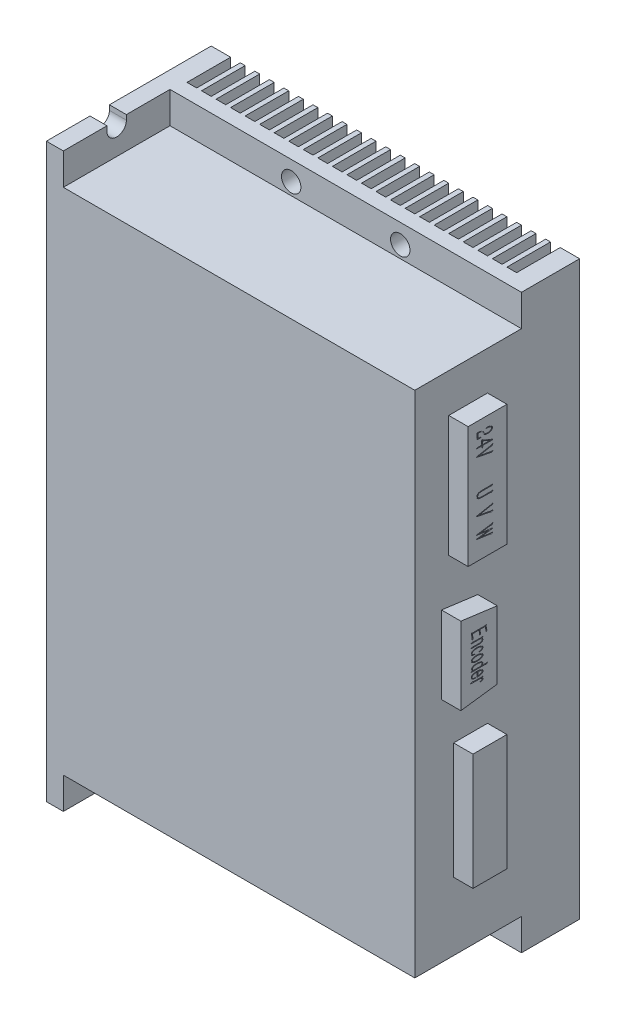
from build123d import *

# Parameters (mm, degrees)
SKETCH_1_W          = 76
SKETCH_1_H          = 118
EXTRUDE_1_DEPTH     = 34
SKETCH_2_W          = 72.5
SKETCH_2_H          = 6.5
CUT_EXTRUDE_1_DEPTH = 22
SKETCH_3_W          = 2
SKETCH_3_H          = 9
CUT_EXTRUDE_2_DEPTH = 129.545711714
CUT_EXTRUDE_3_DEPTH = 100.464817901
SKETCH_6_R          = 2
CUT_EXTRUDE_4_DEPTH = 74.545904033
SKETCH_7_W          = 8
SKETCH_7_H          = 25
SKETCH_7_W_2        = 7
SKETCH_7_H_2        = 24
EXTRUDE_2_DEPTH     = 4
SKETCH_8_W          = 11.552532132
SKETCH_8_H          = 8.353369387
CUT_EXTRUDE_5_DEPTH = 0.2
CUT_EXTRUDE_6_DEPTH = 0.2
CUT_EXTRUDE_7_DEPTH = 0.2


with BuildPart() as part:
    # 草图1 → 凸台-拉伸1 (new body)
    with BuildSketch(Plane.XY):
        Rectangle(SKETCH_1_W, SKETCH_1_H)
    extrude(amount=EXTRUDE_1_DEPTH)

    # 草图2 → 切除-拉伸1 (cut)
    with BuildSketch(Plane.XY.offset(34)):
        with Locations((1.75, 55.75)):
            Rectangle(SKETCH_2_W, SKETCH_2_H)
        with Locations((1.75, -55.75)):
            Rectangle(SKETCH_2_W, SKETCH_2_H)
    extrude(amount=-CUT_EXTRUDE_1_DEPTH, mode=Mode.SUBTRACT)

    # 草图3 → 切除-拉伸2 (cut, through all)
    with BuildSketch(Plane(origin=(0, 59, 0), x_dir=(1, 0, 0), z_dir=(0, 1, 0))):
        with Locations((-33, -4.5)):
            Rectangle(SKETCH_3_W, SKETCH_3_H)
        with Locations((-30, -4.5)):
            Rectangle(SKETCH_3_W, SKETCH_3_H)
        with Locations((-27, -4.5)):
            Rectangle(SKETCH_3_W, SKETCH_3_H)
        with Locations((-24, -4.5)):
            Rectangle(SKETCH_3_W, SKETCH_3_H)
        with Locations((-21, -4.5)):
            Rectangle(SKETCH_3_W, SKETCH_3_H)
        with Locations((-18, -4.5)):
            Rectangle(SKETCH_3_W, SKETCH_3_H)
        with Locations((-15, -4.5)):
            Rectangle(SKETCH_3_W, SKETCH_3_H)
        with Locations((-12, -4.5)):
            Rectangle(SKETCH_3_W, SKETCH_3_H)
        with Locations((-9, -4.5)):
            Rectangle(SKETCH_3_W, SKETCH_3_H)
        with Locations((-6, -4.5)):
            Rectangle(SKETCH_3_W, SKETCH_3_H)
        with Locations((-3, -4.5)):
            Rectangle(SKETCH_3_W, SKETCH_3_H)
        with Locations((0, -4.5)):
            Rectangle(SKETCH_3_W, SKETCH_3_H)
        with Locations((3, -4.5)):
            Rectangle(SKETCH_3_W, SKETCH_3_H)
        with Locations((6, -4.5)):
            Rectangle(SKETCH_3_W, SKETCH_3_H)
        with Locations((9, -4.5)):
            Rectangle(SKETCH_3_W, SKETCH_3_H)
        with Locations((12, -4.5)):
            Rectangle(SKETCH_3_W, SKETCH_3_H)
        with Locations((15, -4.5)):
            Rectangle(SKETCH_3_W, SKETCH_3_H)
        with Locations((18, -4.5)):
            Rectangle(SKETCH_3_W, SKETCH_3_H)
        with Locations((21, -4.5)):
            Rectangle(SKETCH_3_W, SKETCH_3_H)
        with Locations((24, -4.5)):
            Rectangle(SKETCH_3_W, SKETCH_3_H)
        with Locations((27, -4.5)):
            Rectangle(SKETCH_3_W, SKETCH_3_H)
        with Locations((30, -4.5)):
            Rectangle(SKETCH_3_W, SKETCH_3_H)
        with Locations((33, -4.5)):
            Rectangle(SKETCH_3_W, SKETCH_3_H)
    extrude(amount=-CUT_EXTRUDE_2_DEPTH, mode=Mode.SUBTRACT)

    # 草图4 → 切除-拉伸3 (cut, through all)
    with BuildSketch(Plane(origin=(-34.5, 0, 0), x_dir=(0, 0, -1), z_dir=(1, 0, 0))):
        with BuildLine():
            Line((-21, 60), (-21, 58))
            ThreePointArc((-21, 58), (-23, 56), (-25, 58))
            Line((-25, 58), (-25, 60))
            ThreePointArc((-25, 60), (-23, 62), (-21, 60))
        make_face()
        with BuildLine():
            Line((-21, -60), (-21, -58))
            ThreePointArc((-21, -58), (-23, -56), (-25, -58))
            Line((-25, -58), (-25, -60))
            ThreePointArc((-25, -60), (-23, -62), (-21, -60))
        make_face()
    extrude(amount=-CUT_EXTRUDE_3_DEPTH, mode=Mode.SUBTRACT)

    # 草图6 → 切除-拉伸4 (cut, through all)
    with BuildSketch(Plane.XY.offset(12)):
        with Locations((-9.5, 55)):
            Circle(SKETCH_6_R)
        with Locations((13, 55)):
            Circle(SKETCH_6_R)
        with Locations(Location((13, -55, 0), (0, 0, 180))):
            Circle(SKETCH_6_R)
        with Locations(Location((-9.5, -55, 0), (0, 0, 318.590377891))):
            Circle(SKETCH_6_R)
    extrude(amount=-CUT_EXTRUDE_4_DEPTH, mode=Mode.SUBTRACT)

    # 草图7 → 凸台-拉伸2 (add)
    with BuildSketch(Plane(origin=(38, 0, 0), x_dir=(0, 0, -1), z_dir=(1, 0, 0))):
        with Locations((-23, 32)):
            Rectangle(SKETCH_7_W, SKETCH_7_H)
        with Locations((-22.5, -26.5)):
            Rectangle(SKETCH_7_W_2, SKETCH_7_H_2)
        Polygon((-28.5, 10.5), (-28.5, -5.5), (-21, -4.5), (-21, 9.5), align=None)
    extrude(amount=EXTRUDE_2_DEPTH)

    # 草图8 → 切除-拉伸5 (cut)
    with BuildSketch(Plane.XZ.offset(52.5)):
        with Locations((3.688447004, 24.509145886)):
            Rectangle(SKETCH_8_W, SKETCH_8_H)
    extrude(amount=-CUT_EXTRUDE_5_DEPTH, mode=Mode.SUBTRACT)

    # 草图11 → 切除-拉伸6 (cut)
    # profile 1 of 6: a face of its own
    with BuildSketch(Plane(origin=(42, 0, 0), x_dir=(0, 0, -1), z_dir=(1, 0, 0))):
        with BuildLine():
            Line((-23.261703852, 42.333475389), (-23.261703852, 42.409546133))
            add(Edge.make_bspline(
                [(-23.261703852, 42.409546133), (-23.237594597, 42.411113536), (-23.191632211, 42.414101668), (-23.125992936, 42.417185012), (-23.067056893, 42.418487123), (-22.99520695, 42.41979154), (-22.90459509, 42.417779801), (-22.831610741, 42.412378113), (-22.793346724, 42.409546133)],
                knots=[0, 0, 0, 0, 0.927540379, 1.768282303, 2.522502339, 3.190652681, 4.527123766, 6, 6, 6, 6], degree=3))
            add(Edge.make_bspline(
                [(-22.793346724, 42.409546133), (-22.764995991, 42.407466091), (-22.710197958, 42.403445658), (-22.630914098, 42.395059171), (-22.557884489, 42.38192456), (-22.488873574, 42.367243571), (-22.421453527, 42.346807763), (-22.353620304, 42.317886526), (-22.283075621, 42.281771944), (-22.212287295, 42.239114215), (-22.145475048, 42.192312683), (-22.091164476, 42.139755677), (-22.049444707, 42.084646712), (-22.025367431, 42.025910728), (-22.009559096, 41.969906372), (-21.997665068, 41.918877597), (-21.989211092, 41.872854027), (-21.988314343, 41.843770367), (-21.987891791, 41.830066056)],
                knots=[0, 0, 0, 0, 1.238517857, 2.393883215, 3.471122581, 4.469644663, 5.466579596, 6.534633116, 7.677750439, 8.916647077, 10.134150535, 11.221739092, 12.19876719, 13.120314199, 13.9668265, 14.733958786, 15.403437433, 16, 16, 16, 16], degree=3))
            add(Edge.make_bspline(
                [(-21.987891791, 41.830066056), (-21.98922695, 41.81286093), (-21.991902669, 41.778381067), (-22.003206525, 41.727732406), (-22.020894835, 41.678716977), (-22.050232447, 41.61580233), (-22.098885848, 41.542999657), (-22.16038681, 41.479953707), (-22.217668932, 41.436705746), (-22.266433082, 41.406459064), (-22.320264875, 41.378487247), (-22.399235566, 41.344853424), (-22.50399169, 41.31038652), (-22.635900023, 41.284481623), (-22.773110259, 41.268606749), (-22.913255628, 41.259478543), (-23.052118872, 41.259676564), (-23.142659679, 41.267628441), (-23.1863789, 41.271468144)],
                knots=[0, 0, 0, 0, 0.562699445, 1.127675498, 1.687089763, 2.260565652, 3.3901973, 4.526191974, 5.116857852, 5.729192648, 6.396912804, 7.094714077, 8.528954671, 9.986482611, 11.473874068, 13.034690239, 14.568148048, 16, 16, 16, 16], degree=3))
            add(Edge.make_bspline(
                [(-23.1863789, 41.271468144), (-23.231353516, 41.279443414), (-23.321973776, 41.295512946), (-23.431043689, 41.330194433), (-23.514046946, 41.362387767), (-23.569355103, 41.389611448), (-23.618991936, 41.417460936), (-23.677124113, 41.459416063), (-23.742794559, 41.523721869), (-23.787283618, 41.582810162), (-23.810606473, 41.613786491)],
                knots=[0, 0, 0, 0, 1.490633437, 3.003507351, 3.728825759, 4.397077592, 5.0155149, 5.585685925, 6.734324833, 8, 8, 8, 8], degree=3))
            Line((-23.810606473, 41.613786491), (-23.966476918, 41.860643512))
            add(Edge.make_bspline(
                [(-23.966476918, 41.860643512), (-23.987780208, 41.892146142), (-24.028068717, 41.951723513), (-24.094737679, 42.030660829), (-24.164097864, 42.09761329), (-24.241489361, 42.147767952), (-24.320140057, 42.188442066), (-24.400570541, 42.221669538), (-24.487801592, 42.249490049), (-24.566680283, 42.268071715), (-24.63287406, 42.280266538), (-24.678748432, 42.288314349), (-24.719666653, 42.291977448), (-24.745078862, 42.29281106), (-24.757016019, 42.293202642)],
                knots=[0, 0, 0, 0, 1.453965406, 2.74972071, 3.947524274, 5.1266794, 6.26249806, 7.33287466, 8.451802435, 9.762136747, 10.429953745, 11.027267426, 11.543067645, 12, 12, 12, 12], degree=3))
            Line((-24.757016019, 42.293202642), (-24.968075043, 42.303643725))
            Line((-24.968075043, 42.303643725), (-24.938243379, 41.402727466))
            add(Edge.make_bspline(
                [(-24.938243379, 41.402727466), (-24.937521238, 41.391237075), (-24.93624186, 41.37088016), (-24.915433488, 41.350592463), (-24.889256077, 41.346155117), (-24.857154789, 41.339672649), (-24.811494098, 41.333422893), (-24.776652486, 41.329095569), (-24.757016019, 41.326656723)],
                knots=[0, 0, 0, 0, 0.924345848, 1.637614356, 2.191793974, 3.091994019, 4.361069934, 6, 6, 6, 6], degree=3))
            Line((-24.757016019, 41.326656723), (-24.318490555, 41.306520349))
            Line((-24.318490555, 41.306520349), (-24.318490555, 41.236415939))
            Line((-24.318490555, 41.236415939), (-24.982990875, 41.211059024))
            add(Edge.make_bspline(
                [(-24.982990875, 41.211059024), (-24.995908517, 41.210154972), (-25.018501486, 41.208573783), (-25.048404735, 41.208403922), (-25.069199533, 41.207105505), (-25.08601071, 41.207593784), (-25.100702486, 41.212953794), (-25.117747792, 41.218000293), (-25.127503219, 41.237843068), (-25.130347895, 41.266332893), (-25.134863729, 41.309408486), (-25.134561129, 41.343048851), (-25.134386571, 41.36245472)],
                knots=[0, 0, 0, 0, 1.381344118, 2.415972319, 3.185515566, 3.610666902, 4.189877067, 4.866012451, 5.389072784, 6.413796741, 7.931253497, 10, 10, 10, 10], degree=3))
            Line((-25.134386571, 41.36245472), (-25.159743485, 42.364052845))
            add(Edge.make_bspline(
                [(-25.159743485, 42.364052845), (-25.159779104, 42.376228284), (-25.159849311, 42.400226974), (-25.135985337, 42.424819967), (-25.106771193, 42.4351436), (-25.072409498, 42.440310536), (-25.026822905, 42.443771474), (-24.948416766, 42.445433894), (-24.83685688, 42.441879692), (-24.744802455, 42.433873951), (-24.696606899, 42.429682506)],
                knots=[0, 0, 0, 0, 0.556373901, 1.096654043, 1.476064089, 2.012759395, 2.73145082, 3.635924119, 5.715166189, 8, 8, 8, 8], degree=3))
            add(Edge.make_bspline(
                [(-24.696606899, 42.429682506), (-24.6684753, 42.42596276), (-24.614284075, 42.418797238), (-24.536277245, 42.404231268), (-24.463874255, 42.388690374), (-24.397097496, 42.371862468), (-24.336369762, 42.353159064), (-24.281431377, 42.333123459), (-24.2322762, 42.310985375), (-24.176216722, 42.279563896), (-24.114850833, 42.240062663), (-24.048923962, 42.194379982), (-23.993529502, 42.149539242), (-23.932014995, 42.092158487), (-23.864560303, 42.014829093), (-23.815645858, 41.949471149), (-23.790470099, 41.91583209)],
                knots=[0, 0, 0, 0, 1.103682841, 2.126076271, 3.085860347, 3.984189842, 4.803973074, 5.556669856, 6.257774918, 6.898377573, 8.054697162, 9.095718588, 10.017021976, 10.824390499, 12.365546615, 14, 14, 14, 14], degree=3))
            Line((-23.790470099, 41.91583209), (-23.659210777, 41.709247816))
            add(Edge.make_bspline(
                [(-23.659210777, 41.709247816), (-23.64820903, 41.692715326), (-23.627096811, 41.660989679), (-23.593572762, 41.617062082), (-23.558358607, 41.579876066), (-23.521556317, 41.546603565), (-23.477019705, 41.518743454), (-23.423547438, 41.4933892), (-23.359284527, 41.46853196), (-23.260038079, 41.43865641), (-23.128515977, 41.40984339), (-22.96657037, 41.396164476), (-22.802288409, 41.40411824), (-22.693257246, 41.422933259), (-22.637476279, 41.432559131)],
                knots=[0, 0, 0, 0, 0.635422629, 1.219368237, 1.76522997, 2.272581269, 2.802144936, 3.438960165, 4.164269579, 5.004675907, 6.753620776, 8.461916107, 10.189896028, 12, 12, 12, 12], degree=3))
            add(Edge.make_bspline(
                [(-22.637476279, 41.432559131), (-22.609029254, 41.439883257), (-22.553548108, 41.454167737), (-22.473892094, 41.481543473), (-22.400715809, 41.515525965), (-22.333000055, 41.553341718), (-22.273157589, 41.600366381), (-22.23093193, 41.663680839), (-22.202097756, 41.737798198), (-22.197095507, 41.79199202), (-22.194476066, 41.820370765)],
                knots=[0, 0, 0, 0, 1.10059405, 2.146523874, 3.151145, 4.11947505, 5.052242349, 5.969623514, 6.936787711, 8, 8, 8, 8], degree=3))
            add(Edge.make_bspline(
                [(-22.194476066, 41.820370765), (-22.194320709, 41.835304395), (-22.194010839, 41.865090567), (-22.200775105, 41.909433695), (-22.214668004, 41.952436839), (-22.240923502, 42.008742059), (-22.287435237, 42.074765293), (-22.360235183, 42.142853917), (-22.447542239, 42.199943705), (-22.549447808, 42.243316607), (-22.664846445, 42.27780786), (-22.795111623, 42.302635658), (-22.940259988, 42.32192154), (-23.042125376, 42.326569927), (-23.095392324, 42.329000639)],
                knots=[0, 0, 0, 0, 0.469508511, 0.936467637, 1.404147226, 1.887215322, 2.887777093, 3.922713596, 5.007749562, 6.153299202, 7.395822241, 8.792147606, 10.322565615, 12, 12, 12, 12], degree=3))
            Line((-23.095392324, 42.329000639), (-23.261703852, 42.333475389))
        make_face()
    # profile 2 of 6: a face of its own
    with BuildSketch(Plane(origin=(42, 0, 0), x_dir=(0, 0, -1), z_dir=(1, 0, 0))):
        with BuildLine():
            Line((-24.22302923, 39.785105476), (-24.263301977, 40.495099084))
            Line((-24.263301977, 40.495099084), (-24.338626929, 40.545067121))
            add(Edge.make_bspline(
                [(-24.338626929, 40.545067121), (-24.34649482, 40.548378051), (-24.35818582, 40.553297804), (-24.370720518, 40.57093452), (-24.353362437, 40.585265672), (-24.34163574, 40.591684612), (-24.334152179, 40.59578095)],
                knots=[0, 0, 0, 0, 1.284344067, 1.908423106, 2.665230106, 4, 4, 4, 4], degree=3))
            Line((-24.334152179, 40.59578095), (-24.142483737, 40.691242276))
            add(Edge.make_bspline(
                [(-24.142483737, 40.691242276), (-24.131165385, 40.695326065), (-24.11250154, 40.702060192), (-24.087450121, 40.706962885), (-24.069781775, 40.70556892), (-24.060655247, 40.702333468), (-24.056717702, 40.700937567)],
                knots=[0, 0, 0, 0, 1.63130738, 2.690008936, 3.434818089, 4, 4, 4, 4], degree=3))
            Line((-24.056717702, 40.700937567), (-24.047022411, 40.66066482))
            Line((-24.047022411, 40.66066482), (-24.016444955, 40.605476241))
            Line((-24.016444955, 40.605476241), (-21.962534877, 39.75452802))
            Line((-21.962534877, 39.75452802), (-21.962534877, 39.644150863))
            Line((-21.962534877, 39.644150863), (-24.036581329, 39.644150863))
            add(Edge.make_bspline(
                [(-24.036581329, 39.644150863), (-24.036584463, 39.634048175), (-24.036589921, 39.616457156), (-24.029783477, 39.600310509), (-24.026886038, 39.593437034)],
                knots=[0, 0, 0, 0, 1.148618828, 2, 2, 2, 2], degree=3))
            Line((-24.026886038, 39.593437034), (-23.996308582, 39.518112082))
            add(Edge.make_bspline(
                [(-23.996308582, 39.518112082), (-23.992674241, 39.508374437), (-23.986196144, 39.491017394), (-23.976467226, 39.468667957), (-23.968976401, 39.452846696), (-23.963318933, 39.445474741), (-23.961256377, 39.44278713)],
                knots=[0, 0, 0, 0, 1.495147538, 2.665053038, 3.513315187, 4, 4, 4, 4], degree=3))
            Line((-23.961256377, 39.44278713), (-23.931424713, 39.407734924))
            Line((-23.931424713, 39.407734924), (-24.076854075, 39.266780311))
            add(Edge.make_bspline(
                [(-24.076854075, 39.266780311), (-24.085527134, 39.25976176), (-24.099762008, 39.248242388), (-24.123504335, 39.241785704), (-24.139763458, 39.246894502), (-24.151656954, 39.256139924), (-24.15614802, 39.272523628), (-24.156939279, 39.284452301), (-24.157399569, 39.291391434)],
                knots=[0, 0, 0, 0, 1.678640089, 2.755110111, 3.54005336, 4.180221436, 4.941400688, 6, 6, 6, 6], degree=3))
            Line((-24.157399569, 39.291391434), (-24.197672315, 39.644150863))
            Line((-24.197672315, 39.644150863), (-25.099334365, 39.644150863))
            add(Edge.make_bspline(
                [(-25.099334365, 39.644150863), (-25.102069291, 39.644169428), (-25.111273366, 39.644231905), (-25.130648757, 39.643034005), (-25.161487798, 39.642860253), (-25.199788988, 39.640638324), (-25.238176519, 39.64133444), (-25.269502906, 39.641000714), (-25.288652443, 39.643756713), (-25.302021373, 39.647333686), (-25.303867249, 39.657183651), (-25.301657331, 39.662137137), (-25.300698098, 39.664287236)],
                knots=[0, 0, 0, 0, 0.37501259, 1.262061358, 2.660251251, 4.604694151, 6.513849154, 7.946121206, 8.842943116, 9.254878967, 9.676574381, 10, 10, 10, 10], degree=3))
            add(Edge.make_bspline(
                [(-25.300698098, 39.664287236), (-25.298198313, 39.668505054), (-25.290662619, 39.681219819), (-25.266078007, 39.692094592), (-25.241361573, 39.706762227), (-25.22276777, 39.712033768), (-25.214932064, 39.714255274)],
                knots=[0, 0, 0, 0, 0.571804506, 1.72372529, 3.040743854, 4, 4, 4, 4], degree=3))
            Line((-25.214932064, 39.714255274), (-25.123945488, 39.759748562))
            Line((-25.123945488, 39.759748562), (-25.053841077, 39.785105476))
            add(Edge.make_bspline(
                [(-25.053841077, 39.785105476), (-25.045440095, 39.788961567), (-25.030238351, 39.795939239), (-25.009283809, 39.803582563), (-24.993813658, 39.810407686), (-24.975409263, 39.81420467), (-24.946654781, 39.809771731), (-24.906413378, 39.799782692), (-24.863245863, 39.788635763), (-24.824124176, 39.781329235), (-24.790074353, 39.780631305), (-24.768198154, 39.780137398), (-24.757016019, 39.779884935)],
                knots=[0, 0, 0, 0, 0.907818024, 1.642714647, 2.191683433, 2.565372068, 3.472203513, 5.001102341, 6.660103201, 7.848859445, 8.900433038, 10, 10, 10, 10], degree=3))
            Line((-24.757016019, 39.779884935), (-24.22302923, 39.785105476))
        make_face()
        Polygon((-24.056717702, 39.779884935), (-22.385398716, 39.779884935), (-24.092515699, 40.489878543), align=None, mode=Mode.SUBTRACT)
    # profile 3 of 6: a face of its own
    with BuildSketch(Plane(origin=(42, 0, 0), x_dir=(0, 0, -1), z_dir=(1, 0, 0))):
        with BuildLine():
            Line((-21.902125757, 37.684210526), (-21.877514634, 37.629021948))
            Line((-21.877514634, 37.629021948), (-22.189255524, 37.453015129))
            add(Edge.make_bspline(
                [(-22.189255524, 37.453015129), (-22.204385757, 37.462022264), (-22.231280119, 37.478032668), (-22.271357567, 37.500802519), (-22.315590066, 37.523355094), (-22.360664527, 37.543055702), (-22.407535765, 37.560187422), (-22.452481837, 37.572489052), (-22.504660754, 37.584607058), (-22.542217908, 37.590723466), (-22.562151327, 37.593969742)],
                knots=[0, 0, 0, 0, 1.051297708, 1.868707569, 2.751548746, 4.01446034, 4.80320424, 5.728802732, 6.794564463, 8, 8, 8, 8], degree=3))
            Line((-22.562151327, 37.593969742), (-25.244763728, 38.121990198))
            Line((-25.244763728, 38.121990198), (-25.249984269, 38.212976774))
            Line((-25.249984269, 38.212976774), (-22.456248919, 38.756658854))
            add(Edge.make_bspline(
                [(-22.456248919, 38.756658854), (-22.444322293, 38.759664691), (-22.41848127, 38.766177339), (-22.376476513, 38.776211663), (-22.329044701, 38.79025452), (-22.277349793, 38.804081097), (-22.226468082, 38.819307081), (-22.180799052, 38.833448749), (-22.142007532, 38.845125986), (-22.102238815, 38.859631102), (-22.061026991, 38.875390273), (-22.031783212, 38.890661058), (-22.018469247, 38.897613467)],
                knots=[0, 0, 0, 0, 0.80066111, 1.734765739, 2.810621778, 4.019870766, 5.218024494, 6.267388172, 7.132352402, 7.854058573, 9.023006231, 10, 10, 10, 10], degree=3))
            Line((-22.018469247, 38.897613467), (-21.952839586, 38.932665672))
            Line((-21.952839586, 38.932665672), (-21.892430466, 38.897613467))
            Line((-21.892430466, 38.897613467), (-22.083353117, 38.630620072))
            add(Edge.make_bspline(
                [(-22.083353117, 38.630620072), (-22.102416754, 38.635054127), (-22.138291969, 38.643398426), (-22.192857438, 38.648592705), (-22.250632167, 38.648909347), (-22.315950943, 38.640052774), (-22.390948232, 38.628953325), (-22.443580248, 38.620260277), (-22.471164751, 38.61570424)],
                knots=[0, 0, 0, 0, 0.898608142, 1.69106027, 2.513744162, 3.548427424, 4.715127854, 6, 6, 6, 6], degree=3))
            Line((-22.471164751, 38.61570424), (-24.751795477, 38.167483486))
            Line((-24.751795477, 38.167483486), (-22.456248919, 37.719262732))
            add(Edge.make_bspline(
                [(-22.456248919, 37.719262732), (-22.427191277, 37.714351596), (-22.364503238, 37.703756466), (-22.284285658, 37.69361761), (-22.218388004, 37.685770441), (-22.173105601, 37.681380398), (-22.134073427, 37.677677716), (-22.109953744, 37.675501992), (-22.09901474, 37.674515235)],
                knots=[0, 0, 0, 0, 1.472770085, 3.177307748, 4.040376616, 4.789595524, 5.451045058, 6, 6, 6, 6], degree=3))
            add(Edge.make_bspline(
                [(-22.09901474, 37.674515235), (-22.07912151, 37.674871885), (-22.040309464, 37.675567715), (-22.001559704, 37.677868483), (-21.98267125, 37.678989985)],
                knots=[0, 0, 0, 0, 1.025106008, 2, 2, 2, 2], degree=3))
            Line((-21.98267125, 37.678989985), (-21.902125757, 37.684210526))
        make_face()
    # profile 4 of 6: a face of its own
    with BuildSketch(Plane(origin=(42, 0, 0), x_dir=(0, 0, -1), z_dir=(1, 0, 0))):
        with BuildLine():
            add(Edge.make_bspline(
                [(-22.179560234, 31.494140209), (-22.196468208, 31.498603785), (-22.22754363, 31.50680746), (-22.27337819, 31.519087912), (-22.322353343, 31.530962483), (-22.370594239, 31.538201519), (-22.41986946, 31.543937052), (-22.468607467, 31.547854237), (-22.527098568, 31.548653482), (-22.569362233, 31.549093355), (-22.591982991, 31.549328788)],
                knots=[0, 0, 0, 0, 1.003991799, 1.845251774, 2.724635495, 3.895543707, 4.642664118, 5.573149993, 6.701078418, 8, 8, 8, 8], degree=3))
            Line((-22.591982991, 31.549328788), (-23.966476918, 31.549328788))
            add(Edge.make_bspline(
                [(-23.966476918, 31.549328788), (-24.019432325, 31.549123114), (-24.120400233, 31.548730966), (-24.264910718, 31.543616938), (-24.394979326, 31.534630383), (-24.510828993, 31.523443893), (-24.611973834, 31.507380999), (-24.697835933, 31.483249787), (-24.770193869, 31.454951982), (-24.826798805, 31.415977851), (-24.872349474, 31.372931347), (-24.911360829, 31.326991463), (-24.945461626, 31.277925252), (-24.971406909, 31.225200729), (-24.992577382, 31.172354506), (-25.007326163, 31.120346982), (-25.016981056, 31.069892525), (-25.01819521, 31.03676183), (-25.018788872, 31.02056254)],
                knots=[0, 0, 0, 0, 1.904914179, 3.632021954, 5.200698336, 6.594207893, 7.818890705, 8.877780282, 9.799589691, 10.598263126, 11.332232107, 12.049057255, 12.763423687, 13.475322913, 14.157857449, 14.808907837, 15.417614165, 16, 16, 16, 16], degree=3))
            add(Edge.make_bspline(
                [(-25.018788872, 31.02056254), (-25.018636482, 30.99656254), (-25.018341438, 30.950095771), (-24.999987623, 30.884404628), (-24.971925563, 30.824691798), (-24.928673904, 30.775485556), (-24.880149901, 30.733311684), (-24.82862054, 30.69687054), (-24.775331989, 30.666798777), (-24.701097537, 30.637619579), (-24.606786907, 30.611971664), (-24.494636201, 30.59126391), (-24.387831002, 30.580509178), (-24.309813946, 30.577379697), (-24.256092557, 30.577594075), (-24.220046102, 30.57755034), (-24.175795748, 30.577566465), (-24.123093159, 30.577560927), (-24.061938242, 30.57756279), (-23.992331027, 30.577562181), (-23.914271505, 30.57756237), (-23.859580121, 30.577562342), (-23.830742846, 30.577562327)],
                knots=[0, 0, 0, 0, 1.015631779, 1.966380352, 2.873571729, 3.796136189, 4.724429981, 5.603818388, 6.474019664, 7.317647596, 8.986577819, 10.619504524, 12.159630562, 13.544676571, 13.935588137, 14.442716655, 15.076627303, 15.816189725, 16.682534277, 17.675660958, 18.774439414, 20, 20, 20, 20], degree=3))
            Line((-23.830742846, 30.577562327), (-22.536794412, 30.577562327))
            add(Edge.make_bspline(
                [(-22.536794412, 30.577562327), (-22.498010141, 30.577864609), (-22.426635992, 30.578420896), (-22.325886816, 30.582003029), (-22.234560862, 30.58882267), (-22.162297871, 30.597621506), (-22.107885703, 30.605396196), (-22.073533581, 30.611221982), (-22.045964067, 30.617165909), (-22.029895346, 30.621277106), (-22.022943997, 30.623055615)],
                knots=[0, 0, 0, 0, 1.80032665, 3.313115891, 4.678744417, 6.049968309, 6.691325513, 7.230115195, 7.666946866, 8, 8, 8, 8], degree=3))
            Line((-22.022943997, 30.623055615), (-21.942398503, 30.643191988))
            Line((-21.942398503, 30.643191988), (-21.892430466, 30.5976987))
            Line((-21.892430466, 30.5976987), (-22.194476066, 30.376198594))
            add(Edge.make_bspline(
                [(-22.194476066, 30.376198594), (-22.21129138, 30.382440946), (-22.241912041, 30.393808259), (-22.288906716, 30.40666688), (-22.340732341, 30.418535546), (-22.404666009, 30.42665022), (-22.480369216, 30.43606747), (-22.53427185, 30.436423545), (-22.562151327, 30.436607714)],
                knots=[0, 0, 0, 0, 0.861171832, 1.568192575, 2.338910833, 3.413054582, 4.661982145, 6, 6, 6, 6], degree=3))
            Line((-22.562151327, 30.436607714), (-22.798567265, 30.447048796))
            Line((-22.798567265, 30.447048796), (-23.996308582, 30.447048796))
            add(Edge.make_bspline(
                [(-23.996308582, 30.447048796), (-24.027383205, 30.447052187), (-24.086549288, 30.447058644), (-24.170326886, 30.447015563), (-24.244407782, 30.447150746), (-24.330951412, 30.446600017), (-24.436309794, 30.45059551), (-24.5641919, 30.462265626), (-24.69301681, 30.486395004), (-24.798115071, 30.517302189), (-24.877688074, 30.55240313), (-24.936463491, 30.583327781), (-24.992105174, 30.622467204), (-25.04711372, 30.66417034), (-25.095547934, 30.712145566), (-25.136898114, 30.763249563), (-25.16845218, 30.818171544), (-25.190775435, 30.875655848), (-25.204234067, 30.933337986), (-25.212654859, 30.988683858), (-25.215722547, 31.04131823), (-25.211677696, 31.0750271), (-25.209711523, 31.091412742)],
                knots=[0, 0, 0, 0, 1.184236701, 2.254786678, 3.192702146, 4.007456996, 5.552747496, 7.209053985, 8.89620522, 10.541419882, 11.368692076, 12.207974253, 13.067230812, 13.95797836, 14.835580057, 15.658228303, 16.45611915, 17.239020532, 17.999591886, 18.70836324, 19.372144549, 20, 20, 20, 20], degree=3))
            add(Edge.make_bspline(
                [(-25.209711523, 31.091412742), (-25.205982102, 31.116685848), (-25.198424642, 31.167900375), (-25.172718613, 31.243430539), (-25.135627083, 31.318435901), (-25.087909133, 31.391803517), (-25.030446111, 31.460448469), (-24.962958495, 31.51920453), (-24.886293458, 31.565874995), (-24.801744956, 31.601406651), (-24.710411738, 31.628299881), (-24.613466927, 31.649918556), (-24.510767239, 31.665442857), (-24.366213491, 31.678518801), (-24.180651902, 31.688162168), (-24.031124441, 31.689574278), (-23.956035835, 31.690283401)],
                knots=[0, 0, 0, 0, 0.695526311, 1.409444921, 2.164416956, 2.973007483, 3.790726612, 4.598151018, 5.401609395, 6.227716754, 7.092026239, 7.995034159, 8.934684323, 9.922294222, 11.95228756, 14, 14, 14, 14], degree=3))
            Line((-23.956035835, 31.690283401), (-22.52635333, 31.690283401))
            add(Edge.make_bspline(
                [(-22.52635333, 31.690283401), (-22.488064548, 31.69078904), (-22.41592396, 31.691741725), (-22.312911482, 31.696757693), (-22.219792777, 31.705763578), (-22.147371402, 31.71262698), (-22.094978445, 31.719716895), (-22.062374157, 31.724769718), (-22.035728762, 31.729931883), (-22.020194082, 31.733970894), (-22.013248706, 31.735776689)],
                knots=[0, 0, 0, 0, 1.780947527, 3.355515568, 4.794883523, 6.131779065, 6.738447109, 7.253590661, 7.666289006, 8, 8, 8, 8], degree=3))
            Line((-22.013248706, 31.735776689), (-21.932703212, 31.755913062))
            Line((-21.932703212, 31.755913062), (-21.881989383, 31.715640315))
            Line((-21.881989383, 31.715640315), (-22.179560234, 31.494140209))
        make_face()
    # profile 5 of 6: a face of its own
    with BuildSketch(Plane(origin=(42, 0, 0), x_dir=(0, 0, -1), z_dir=(1, 0, 0))):
        with BuildLine():
            Line((-21.902125757, 27.088003409), (-21.877514634, 27.032814831))
            Line((-21.877514634, 27.032814831), (-22.189255524, 26.856808012))
            add(Edge.make_bspline(
                [(-22.189255524, 26.856808012), (-22.204385757, 26.865815147), (-22.231280119, 26.881825551), (-22.271357567, 26.904595402), (-22.315590066, 26.927147977), (-22.360664527, 26.946848585), (-22.407535765, 26.963980305), (-22.452481837, 26.976281935), (-22.504660754, 26.988399941), (-22.542217908, 26.994516349), (-22.562151327, 26.997762625)],
                knots=[0, 0, 0, 0, 1.051297708, 1.868707569, 2.751548746, 4.01446034, 4.80320424, 5.728802732, 6.794564463, 8, 8, 8, 8], degree=3))
            Line((-22.562151327, 26.997762625), (-25.244763728, 27.525783081))
            Line((-25.244763728, 27.525783081), (-25.249984269, 27.616769657))
            Line((-25.249984269, 27.616769657), (-22.456248919, 28.160451737))
            add(Edge.make_bspline(
                [(-22.456248919, 28.160451737), (-22.444322293, 28.163457574), (-22.41848127, 28.169970222), (-22.376476513, 28.180004546), (-22.329044701, 28.194047403), (-22.277349793, 28.20787398), (-22.226468082, 28.223099964), (-22.180799052, 28.237241632), (-22.142007532, 28.248918869), (-22.102238815, 28.263423985), (-22.061026991, 28.279183156), (-22.031783212, 28.294453941), (-22.018469247, 28.30140635)],
                knots=[0, 0, 0, 0, 0.80066111, 1.734765739, 2.810621778, 4.019870766, 5.218024494, 6.267388172, 7.132352402, 7.854058573, 9.023006231, 10, 10, 10, 10], degree=3))
            Line((-22.018469247, 28.30140635), (-21.952839586, 28.336458555))
            Line((-21.952839586, 28.336458555), (-21.892430466, 28.30140635))
            Line((-21.892430466, 28.30140635), (-22.083353117, 28.034412955))
            add(Edge.make_bspline(
                [(-22.083353117, 28.034412955), (-22.102416754, 28.03884701), (-22.138291969, 28.047191309), (-22.192857438, 28.052385588), (-22.250632167, 28.052702231), (-22.315950943, 28.043845657), (-22.390948232, 28.032746208), (-22.443580248, 28.02405316), (-22.471164751, 28.019497123)],
                knots=[0, 0, 0, 0, 0.898608142, 1.69106027, 2.513744162, 3.548427424, 4.715127854, 6, 6, 6, 6], degree=3))
            Line((-22.471164751, 28.019497123), (-24.751795477, 27.571276369))
            Line((-24.751795477, 27.571276369), (-22.456248919, 27.123055615))
            add(Edge.make_bspline(
                [(-22.456248919, 27.123055615), (-22.427191277, 27.118144479), (-22.364503238, 27.107549349), (-22.284285658, 27.097410493), (-22.218388004, 27.089563324), (-22.173105601, 27.085173281), (-22.134073427, 27.081470599), (-22.109953744, 27.079294875), (-22.09901474, 27.078308118)],
                knots=[0, 0, 0, 0, 1.472770085, 3.177307748, 4.040376616, 4.789595524, 5.451045058, 6, 6, 6, 6], degree=3))
            add(Edge.make_bspline(
                [(-22.09901474, 27.078308118), (-22.07912151, 27.078664768), (-22.040309464, 27.079360598), (-22.001559704, 27.081661366), (-21.98267125, 27.082782868)],
                knots=[0, 0, 0, 0, 1.025106008, 2, 2, 2, 2], degree=3))
            Line((-21.98267125, 27.082782868), (-21.902125757, 27.088003409))
        make_face()
    # profile 6 of 6: a face of its own
    with BuildSketch(Plane(origin=(42, 0, 0), x_dir=(0, 0, -1), z_dir=(1, 0, 0))):
        with BuildLine():
            Line((-24.550431744, 24.227892606), (-22.002807623, 23.901235883))
            Line((-22.002807623, 23.901235883), (-22.002807623, 23.795333475))
            Line((-22.002807623, 23.795333475), (-24.530295371, 23.478372043))
            Line((-24.530295371, 23.478372043), (-22.46594421, 23.180801193))
            add(Edge.make_bspline(
                [(-22.46594421, 23.180801193), (-22.432419012, 23.176280422), (-22.368979112, 23.167725744), (-22.277132159, 23.159969109), (-22.191506234, 23.157527075), (-22.13605585, 23.156631654), (-22.108710031, 23.15619007)],
                knots=[0, 0, 0, 0, 1.132545353, 2.143121272, 3.084264754, 4, 4, 4, 4], degree=3))
            add(Edge.make_bspline(
                [(-22.108710031, 23.15619007), (-22.096281751, 23.156966319), (-22.07366848, 23.158378705), (-22.042842133, 23.159890656), (-22.018474461, 23.160785477), (-22.004299635, 23.160700563), (-21.998332874, 23.16066482)],
                knots=[0, 0, 0, 0, 1.352376053, 2.460649923, 3.352024802, 4, 4, 4, 4], degree=3))
            Line((-21.998332874, 23.16066482), (-21.91778738, 23.176326444))
            Line((-21.91778738, 23.176326444), (-21.887209925, 23.125612615))
            Line((-21.887209925, 23.125612615), (-22.204171356, 22.944385255))
            add(Edge.make_bspline(
                [(-22.204171356, 22.944385255), (-22.216785348, 22.952922532), (-22.237456449, 22.966912941), (-22.265047811, 22.977976739), (-22.285673595, 22.984764407), (-22.306611439, 22.991105319), (-22.333964712, 23.002006655), (-22.366231495, 23.014554681), (-22.399034849, 23.027437964), (-22.428961564, 23.037710084), (-22.4543398, 23.042977013), (-22.469659609, 23.044429467), (-22.476385292, 23.045067121)],
                knots=[0, 0, 0, 0, 1.558913717, 2.554660092, 3.03909494, 3.790012362, 4.800058698, 6.061244404, 7.346240244, 8.420101177, 9.306394852, 10, 10, 10, 10], degree=3))
            Line((-22.476385292, 23.045067121), (-25.224627355, 23.442574046))
            Line((-25.224627355, 23.442574046), (-25.224627355, 23.52311954))
            Line((-25.224627355, 23.52311954), (-22.727717063, 23.850522054))
            Line((-22.727717063, 23.850522054), (-25.224627355, 24.192840401))
            Line((-25.224627355, 24.192840401), (-25.224627355, 24.268165353))
            Line((-25.224627355, 24.268165353), (-22.436112545, 24.67611336))
            add(Edge.make_bspline(
                [(-22.436112545, 24.67611336), (-22.406981134, 24.680322469), (-22.344500062, 24.689350167), (-22.266449281, 24.705368115), (-22.204087032, 24.718491939), (-22.164496553, 24.728020067), (-22.133359933, 24.733903462), (-22.108820652, 24.740796858), (-22.08580349, 24.748347145), (-22.058758706, 24.757453371), (-22.025257208, 24.768340476), (-22.001037131, 24.777204732), (-21.987891791, 24.782015768)],
                knots=[0, 0, 0, 0, 1.91282206, 4.102622189, 5.177030275, 6.055123718, 6.749199987, 7.235308582, 7.710553044, 8.323736257, 9.090215273, 10, 10, 10, 10], degree=3))
            Line((-21.987891791, 24.782015768), (-21.91778738, 24.811847432))
            Line((-21.91778738, 24.811847432), (-21.867073551, 24.776795227))
            Line((-21.867073551, 24.776795227), (-22.083353117, 24.525463456))
            add(Edge.make_bspline(
                [(-22.083353117, 24.525463456), (-22.098749209, 24.528526728), (-22.126490326, 24.534046219), (-22.16842925, 24.541168701), (-22.216275934, 24.545021914), (-22.264576201, 24.545879525), (-22.313597957, 24.545159888), (-22.358133656, 24.542007926), (-22.408070355, 24.53657932), (-22.443079277, 24.532225347), (-22.46146946, 24.529938206)],
                knots=[0, 0, 0, 0, 0.990439117, 1.784601331, 2.682008526, 4.015497171, 4.831203523, 5.774318019, 6.830849532, 8, 8, 8, 8], degree=3))
            Line((-22.46146946, 24.529938206), (-24.550431744, 24.227892606))
        make_face()
    extrude(amount=-CUT_EXTRUDE_6_DEPTH, mode=Mode.SUBTRACT)

    # 草图12 → 切除-拉伸7 (cut)
    # profile 1 of 7: a face of its own
    with BuildSketch(Plane(origin=(42, 0, 0), x_dir=(0, 0, -1), z_dir=(1, 0, 0))):
        with BuildLine():
            Line((-23.465950386, 7.043362455), (-24.573450919, 7.043362455))
            Line((-24.573450919, 7.043362455), (-24.51826234, 6.620498615))
            add(Edge.make_bspline(
                [(-24.51826234, 6.620498615), (-24.515836948, 6.605324316), (-24.510456528, 6.571662091), (-24.500707366, 6.519587368), (-24.488759866, 6.467595942), (-24.476190503, 6.420923859), (-24.4618684, 6.380897184), (-24.448290333, 6.344378367), (-24.432444361, 6.311432775), (-24.418835326, 6.292438558), (-24.412359932, 6.28340081)],
                knots=[0, 0, 0, 0, 1.0349619, 2.295929578, 3.567192849, 4.627442236, 5.548769194, 6.428698295, 7.252349857, 8, 8, 8, 8], degree=3))
            Line((-24.412359932, 6.28340081), (-24.387003018, 6.237907522))
            Line((-24.387003018, 6.237907522), (-24.533178172, 6.091732367))
            add(Edge.make_bspline(
                [(-24.533178172, 6.091732367), (-24.541619583, 6.085058114), (-24.555647869, 6.073966564), (-24.579500492, 6.067131254), (-24.596733129, 6.073949838), (-24.610487502, 6.083453723), (-24.617929077, 6.09948056), (-24.618597095, 6.111068178), (-24.618944207, 6.117089282)],
                knots=[0, 0, 0, 0, 1.602599907, 2.663267053, 3.483184695, 4.275877525, 5.104119417, 6, 6, 6, 6], degree=3))
            Line((-24.618944207, 6.117089282), (-24.749457738, 7.043362455))
            Line((-24.749457738, 7.043362455), (-26.113510582, 7.043362455))
            Line((-26.113510582, 7.043362455), (-26.008353966, 6.293096101))
            add(Edge.make_bspline(
                [(-26.008353966, 6.293096101), (-26.006036389, 6.281376036), (-26.001353546, 6.257694748), (-25.991059585, 6.222228097), (-25.975598621, 6.187183913), (-25.963724069, 6.164013075), (-25.957640137, 6.152141487)],
                knots=[0, 0, 0, 0, 0.952294954, 1.924184826, 2.936455269, 4, 4, 4, 4], degree=3))
            Line((-25.957640137, 6.152141487), (-25.932283222, 6.107393991))
            Line((-25.932283222, 6.107393991), (-26.088899459, 5.966439378))
            add(Edge.make_bspline(
                [(-26.088899459, 5.966439378), (-26.097232856, 5.959557449), (-26.111013963, 5.948176662), (-26.135520412, 5.943143023), (-26.150263046, 5.951052533), (-26.163946513, 5.957365731), (-26.168514217, 5.975383548), (-26.1690846, 5.988184032), (-26.169444953, 5.996271042)],
                knots=[0, 0, 0, 0, 1.600647695, 2.647023827, 3.443920148, 4.059639376, 4.774131173, 6, 6, 6, 6], degree=3))
            Line((-26.169444953, 5.996271042), (-26.173919702, 6.071595994))
            add(Edge.make_bspline(
                [(-26.173919702, 6.071595994), (-26.175817555, 6.092984446), (-26.179860467, 6.138547337), (-26.188323799, 6.211371285), (-26.19887208, 6.292867424), (-26.210728976, 6.38365102), (-26.224870594, 6.483099366), (-26.241421694, 6.591718227), (-26.260114216, 6.709010209), (-26.273106613, 6.790291062), (-26.27982211, 6.832303431)],
                knots=[0, 0, 0, 0, 0.670817482, 1.429013343, 2.290238854, 3.238186532, 4.289330328, 5.428386308, 6.670786803, 8, 8, 8, 8], degree=3))
            Line((-26.27982211, 6.832303431), (-26.320094857, 7.063498828))
            add(Edge.make_bspline(
                [(-26.320094857, 7.063498828), (-26.327084995, 7.081527941), (-26.339433669, 7.113377903), (-26.352452183, 7.157405223), (-26.350905838, 7.195265859), (-26.331611826, 7.225365204), (-26.294016101, 7.240883257), (-26.265971753, 7.237155303), (-26.249990446, 7.235030897)],
                knots=[0, 0, 0, 0, 1.381994289, 2.441410496, 3.261262031, 4.004891186, 4.863070482, 6, 6, 6, 6], degree=3))
            add(Edge.make_bspline(
                [(-26.249990446, 7.235030897), (-26.24423579, 7.234186284), (-26.227878664, 7.231785543), (-26.199581466, 7.220748299), (-26.16250793, 7.210867778), (-26.117891972, 7.200583111), (-26.060907173, 7.194483767), (-26.017806633, 7.19135861), (-25.992692342, 7.189537609)],
                knots=[0, 0, 0, 0, 0.398372487, 1.132340191, 2.07227747, 3.032898756, 4.271097258, 6, 6, 6, 6], degree=3))
            Line((-25.992692342, 7.189537609), (-25.897231017, 7.189537609))
            add(Edge.make_bspline(
                [(-25.897231017, 7.189537609), (-25.883312887, 7.188714904), (-25.85771964, 7.18720208), (-25.822884558, 7.186206222), (-25.794831375, 7.183999049), (-25.778404293, 7.184220044), (-25.771192236, 7.184317068)],
                knots=[0, 0, 0, 0, 1.325956836, 2.438225671, 3.314326982, 4, 4, 4, 4], degree=3))
            Line((-25.771192236, 7.184317068), (-23.465950386, 7.189537609))
            add(Edge.make_bspline(
                [(-23.465950386, 7.189537609), (-23.454258506, 7.199473554), (-23.430874744, 7.219345443), (-23.396857934, 7.24850905), (-23.366054175, 7.274038757), (-23.339410396, 7.294082668), (-23.316141197, 7.308310418), (-23.292865962, 7.313026506), (-23.272818823, 7.314214736), (-23.257698699, 7.31426415), (-23.24699785, 7.309340753), (-23.24375819, 7.299344772), (-23.24236254, 7.286303557), (-23.243680111, 7.276066843), (-23.24445028, 7.270083102)],
                knots=[0, 0, 0, 0, 1.840519835, 3.681039669, 5.376433864, 6.634973726, 7.689336398, 8.608024564, 9.445164623, 10.103951481, 10.410986526, 10.77132567, 11.281794027, 12, 12, 12, 12], degree=3))
            Line((-23.24445028, 7.270083102), (-23.259366112, 7.174621777))
            add(Edge.make_bspline(
                [(-23.259366112, 7.174621777), (-23.262264421, 7.15350432), (-23.267336429, 7.11654901), (-23.272022298, 7.06785038), (-23.273960972, 7.031553323), (-23.271038602, 7.011527884), (-23.269807194, 7.003089708)],
                knots=[0, 0, 0, 0, 1.482629705, 2.594585164, 3.407796403, 4, 4, 4, 4], degree=3))
            Line((-23.269807194, 7.003089708), (-23.269807194, 6.988173876))
            add(Edge.make_bspline(
                [(-23.269807194, 6.988173876), (-23.269548609, 6.969034729), (-23.269061584, 6.932987595), (-23.268519663, 6.881637081), (-23.263138495, 6.835242608), (-23.257086661, 6.806162926), (-23.254145571, 6.792030684)],
                knots=[0, 0, 0, 0, 1.164612609, 2.193459658, 3.122051398, 4, 4, 4, 4], degree=3))
            Line((-23.254145571, 6.792030684), (-23.219093365, 6.5951417))
            add(Edge.make_bspline(
                [(-23.219093365, 6.5951417), (-23.216209448, 6.575736598), (-23.211096386, 6.54133218), (-23.202604082, 6.493223383), (-23.191917921, 6.44872588), (-23.17910099, 6.403487048), (-23.164690227, 6.358216306), (-23.150556855, 6.317474133), (-23.13514108, 6.284527979), (-23.123537805, 6.266159193), (-23.118411499, 6.258043895)],
                knots=[0, 0, 0, 0, 1.329475145, 2.357102735, 3.309182591, 4.429180097, 5.542697331, 6.528604917, 7.34994026, 8, 8, 8, 8], degree=3))
            Line((-23.118411499, 6.258043895), (-23.088579834, 6.212550607))
            Line((-23.088579834, 6.212550607), (-23.239229739, 6.067121244))
            add(Edge.make_bspline(
                [(-23.239229739, 6.067121244), (-23.247924621, 6.061846425), (-23.262100767, 6.053246354), (-23.28275805, 6.045363141), (-23.298935812, 6.049250853), (-23.311484066, 6.058498673), (-23.318756633, 6.074103185), (-23.319426933, 6.085704267), (-23.319775232, 6.091732367)],
                knots=[0, 0, 0, 0, 1.62423055, 2.648147421, 3.375381479, 4.164177564, 5.046078398, 6, 6, 6, 6], degree=3))
            Line((-23.319775232, 6.091732367), (-23.330216314, 6.172277861))
            add(Edge.make_bspline(
                [(-23.330216314, 6.172277861), (-23.33243805, 6.189681692), (-23.336596508, 6.222256709), (-23.342668773, 6.267984906), (-23.34770152, 6.307287746), (-23.352487125, 6.340031319), (-23.355347745, 6.366430135), (-23.357542705, 6.386322012), (-23.359122484, 6.399985633), (-23.359804561, 6.406953074), (-23.360047978, 6.409439591)],
                knots=[0, 0, 0, 0, 1.761538881, 3.297099284, 4.631434889, 5.739811667, 6.619076803, 7.297127464, 7.749161238, 8, 8, 8, 8], degree=3))
            Line((-23.360047978, 6.409439591), (-23.465950386, 7.043362455))
        make_face()
    # profile 2 of 7: a face of its own
    with BuildSketch(Plane(origin=(42, 0, 0), x_dir=(0, 0, -1), z_dir=(1, 0, 0))):
        with BuildLine():
            Line((-24.618944207, 5.350415512), (-25.968081219, 5.355636054))
            Line((-25.968081219, 5.355636054), (-26.285042651, 5.365331345))
            add(Edge.make_bspline(
                [(-26.285042651, 5.365331345), (-26.307975427, 5.365567625), (-26.349265044, 5.365993038), (-26.396801216, 5.372278982), (-26.426805587, 5.379101409), (-26.439810894, 5.385101184), (-26.449313212, 5.392868361), (-26.44713326, 5.398532182), (-26.446133638, 5.401129342)],
                knots=[0, 0, 0, 0, 2.340349786, 4.213713437, 4.922886068, 5.434555744, 5.740714137, 6, 6, 6, 6], degree=3))
            add(Edge.make_bspline(
                [(-26.446133638, 5.401129342), (-26.44548804, 5.403410607), (-26.44367163, 5.409829014), (-26.435199661, 5.420684231), (-26.417344446, 5.433029343), (-26.400903262, 5.438243776), (-26.390945059, 5.441402088)],
                knots=[0, 0, 0, 0, 0.396608432, 1.115869484, 2.253121063, 4, 4, 4, 4], degree=3))
            Line((-26.390945059, 5.441402088), (-26.325315398, 5.461538462))
            Line((-26.325315398, 5.461538462), (-26.149308579, 5.521947582))
            add(Edge.make_bspline(
                [(-26.149308579, 5.521947582), (-26.133433015, 5.527046869), (-26.105263939, 5.536094875), (-26.067934632, 5.546371858), (-26.041234271, 5.553462692), (-26.016776042, 5.554880609), (-25.988872087, 5.547642597), (-25.955169811, 5.533647973), (-25.921026171, 5.520226593), (-25.894518766, 5.510433539), (-25.873825897, 5.504730429), (-25.853495459, 5.502324233), (-25.827415572, 5.499232807), (-25.7856393, 5.495453943), (-25.732860173, 5.491934618), (-25.679506061, 5.486647353), (-25.632768489, 5.483217025), (-25.58597172, 5.483533077), (-25.526837788, 5.481039639), (-25.483320328, 5.481449842), (-25.459451345, 5.481674835)],
                knots=[0, 0, 0, 0, 1.279536346, 2.270366967, 2.974101608, 3.394354146, 4.135391579, 5.15609226, 6.201468135, 6.94984033, 7.324755598, 7.845611527, 8.517853099, 9.341951163, 11.064579688, 12.57801826, 13.457686562, 14.660047141, 16.168062265, 18, 18, 18, 18], degree=3))
            Line((-25.459451345, 5.481674835), (-24.563009837, 5.481674835))
            Line((-24.563009837, 5.481674835), (-24.236353114, 5.496590667))
            add(Edge.make_bspline(
                [(-24.236353114, 5.496590667), (-24.215951629, 5.497405775), (-24.179597483, 5.498858246), (-24.132443763, 5.502975151), (-24.098824995, 5.505530273), (-24.081700804, 5.509873464), (-24.075262127, 5.511506499)],
                knots=[0, 0, 0, 0, 1.511513781, 2.69342123, 3.508727833, 4, 4, 4, 4], degree=3))
            Line((-24.075262127, 5.511506499), (-23.954443887, 5.551779246))
            Line((-23.954443887, 5.551779246), (-23.888814226, 5.506285958))
            Line((-23.888814226, 5.506285958), (-24.16028237, 5.350415512))
            add(Edge.make_bspline(
                [(-24.16028237, 5.350415512), (-24.144490726, 5.335641619), (-24.114314808, 5.307410501), (-24.070643668, 5.262168279), (-24.03171563, 5.205800424), (-24.001510597, 5.136322331), (-23.973927647, 5.064398249), (-23.963613585, 5.0154586), (-23.958918637, 4.993181334)],
                knots=[0, 0, 0, 0, 0.929387143, 1.775946141, 2.697503222, 3.853991443, 5.023139634, 6, 6, 6, 6], degree=3))
            add(Edge.make_bspline(
                [(-23.958918637, 4.993181334), (-23.95922893, 4.966422243), (-23.959896015, 4.908894161), (-23.981723592, 4.838056812), (-24.003973095, 4.7799154), (-24.02656086, 4.738534795), (-24.053662113, 4.701251331), (-24.084147507, 4.667089598), (-24.120091103, 4.63800532), (-24.159280507, 4.611730301), (-24.20359217, 4.590016096), (-24.270458466, 4.564530058), (-24.366824639, 4.540792245), (-24.493969946, 4.519654085), (-24.633874574, 4.507363903), (-24.730542066, 4.505594008), (-24.780035193, 4.504687833)],
                knots=[0, 0, 0, 0, 1.030072704, 2.214503736, 2.835633906, 3.437808196, 4.030004212, 4.615137879, 5.202163146, 5.81264158, 6.43592472, 7.105305516, 8.57640546, 10.26243868, 12.086392927, 14, 14, 14, 14], degree=3))
            Line((-24.780035193, 4.504687833), (-25.645899246, 4.504687833))
            Line((-25.645899246, 4.504687833), (-26.274601569, 4.504687833))
            add(Edge.make_bspline(
                [(-26.274601569, 4.504687833), (-26.295595084, 4.505087802), (-26.335590772, 4.5058498), (-26.381889941, 4.514486275), (-26.413956517, 4.522309373), (-26.427214507, 4.527753539), (-26.438851674, 4.533125484), (-26.436578418, 4.537885222), (-26.435692555, 4.539740038)],
                knots=[0, 0, 0, 0, 2.179719825, 4.152682156, 4.957445275, 5.515772157, 5.811301919, 6, 6, 6, 6], degree=3))
            add(Edge.make_bspline(
                [(-26.435692555, 4.539740038), (-26.435040555, 4.542014218), (-26.433492465, 4.547413959), (-26.426684463, 4.557790422), (-26.408537487, 4.570040076), (-26.37922929, 4.580306985), (-26.346936151, 4.592577388), (-26.324624877, 4.597846451), (-26.314874316, 4.600149158)],
                knots=[0, 0, 0, 0, 0.303306411, 0.720161202, 1.56422782, 3.054584434, 4.712782773, 6, 6, 6, 6], degree=3))
            Line((-26.314874316, 4.600149158), (-26.138867497, 4.660558278))
            add(Edge.make_bspline(
                [(-26.138867497, 4.660558278), (-26.12297546, 4.666339706), (-26.095259987, 4.676422429), (-26.059167603, 4.688722181), (-26.034087633, 4.695932273), (-26.013603008, 4.696434226), (-25.99494482, 4.689066137), (-25.969612479, 4.679017059), (-25.932490423, 4.666811417), (-25.891075691, 4.65369379), (-25.844575832, 4.644335154), (-25.79612412, 4.639977514), (-25.736955806, 4.635768161), (-25.693889696, 4.635884175), (-25.670510369, 4.635947155)],
                knots=[0, 0, 0, 0, 1.262912295, 2.202499957, 2.851130266, 3.203964669, 3.709129587, 4.326432692, 5.248421788, 6.623371576, 7.570271315, 8.784315747, 10.254299444, 12, 12, 12, 12], degree=3))
            Line((-25.670510369, 4.635947155), (-24.870275978, 4.635947155))
            add(Edge.make_bspline(
                [(-24.870275978, 4.635947155), (-24.837959781, 4.636750701), (-24.779295781, 4.638209386), (-24.7002279, 4.639405585), (-24.638833427, 4.641080017), (-24.577489019, 4.642399749), (-24.504989287, 4.651017496), (-24.431170022, 4.667957766), (-24.36770318, 4.689526463), (-24.319555625, 4.712596375), (-24.27415592, 4.743295849), (-24.229880041, 4.777687792), (-24.192656113, 4.821124611), (-24.166415212, 4.873375913), (-24.15389257, 4.933942729), (-24.155149053, 4.976234988), (-24.15580762, 4.998401875)],
                knots=[0, 0, 0, 0, 1.488670557, 2.70240253, 3.641439364, 4.317274907, 5.527167401, 6.996207642, 7.796358584, 8.610474253, 9.44556999, 10.31631565, 11.185554828, 12.055924112, 12.981040187, 14, 14, 14, 14], degree=3))
            add(Edge.make_bspline(
                [(-24.15580762, 4.998401875), (-24.158133303, 5.019736872), (-24.162700418, 5.061633993), (-24.185212243, 5.120770334), (-24.215534739, 5.176493053), (-24.256992971, 5.223767424), (-24.298678899, 5.264270368), (-24.335992211, 5.294672778), (-24.367713054, 5.315606026), (-24.388562144, 5.319096756), (-24.3974441, 5.320583848)],
                knots=[0, 0, 0, 0, 1.206336836, 2.368973488, 3.543567751, 4.768603579, 5.899663321, 6.817683437, 7.496319282, 8, 8, 8, 8], degree=3))
            Line((-24.3974441, 5.320583848), (-24.618944207, 5.350415512))
        make_face()
    # profile 3 of 7: a face of its own
    with BuildSketch(Plane(origin=(42, 0, 0), x_dir=(0, 0, -1), z_dir=(1, 0, 0))):
        with BuildLine():
            Line((-24.744237196, 3.123481781), (-24.744237196, 3.17867036))
            add(Edge.make_bspline(
                [(-24.744237196, 3.17867036), (-24.714638498, 3.182257477), (-24.656802565, 3.189266713), (-24.569070793, 3.202404269), (-24.477709855, 3.224258755), (-24.380963931, 3.254883418), (-24.284264178, 3.296722055), (-24.213218527, 3.346864473), (-24.165868528, 3.393708759), (-24.138591743, 3.434681766), (-24.119662891, 3.480932007), (-24.113472443, 3.513876882), (-24.110314333, 3.530683997)],
                knots=[0, 0, 0, 0, 1.149050543, 2.245247742, 3.416409988, 4.764616832, 6.153695296, 7.458908589, 8.088939939, 8.710686348, 9.342245401, 10, 10, 10, 10], degree=3))
            add(Edge.make_bspline(
                [(-24.110314333, 3.530683997), (-24.109903004, 3.54462623), (-24.109099002, 3.571878382), (-24.114855331, 3.611642081), (-24.123994343, 3.64965331), (-24.145626311, 3.695902653), (-24.180941669, 3.749742926), (-24.231337508, 3.792481997), (-24.2799135, 3.821733023), (-24.32492553, 3.844259205), (-24.378641506, 3.865158217), (-24.460881912, 3.894314031), (-24.572346393, 3.926739226), (-24.690224336, 3.950748105), (-24.792443606, 3.966032733), (-24.880373174, 3.973487993), (-24.978819654, 3.979974931), (-25.083571034, 3.981199529), (-25.1854958, 3.982023526), (-25.275984448, 3.981909985), (-25.350344368, 3.981746648), (-25.394570544, 3.979770875), (-25.413958057, 3.978904752)],
                knots=[0, 0, 0, 0, 0.551983187, 1.078932611, 1.588160416, 2.095572446, 3.096175491, 4.116156307, 4.682474593, 5.343691697, 6.108788431, 6.966107114, 8.803423636, 10.705615502, 11.731579775, 12.899729992, 14.203220565, 15.642623362, 17.052186321, 18.244864277, 19.230597822, 20, 20, 20, 20], degree=3))
            add(Edge.make_bspline(
                [(-25.413958057, 3.978904752), (-25.468534606, 3.973132985), (-25.572880286, 3.962097861), (-25.720725032, 3.931420133), (-25.853598197, 3.89051802), (-25.953496643, 3.847048366), (-26.023581714, 3.80705612), (-26.067526026, 3.775533055), (-26.103958379, 3.742137302), (-26.132002287, 3.705560073), (-26.153544069, 3.666627672), (-26.168417943, 3.624291858), (-26.177527827, 3.578555211), (-26.17859452, 3.546886032), (-26.179140244, 3.530683997)],
                knots=[0, 0, 0, 0, 2.034045719, 3.88892099, 5.588677323, 7.181673786, 7.916870438, 8.576978187, 9.183483509, 9.742148281, 10.278463547, 10.826610433, 11.399690855, 12, 12, 12, 12], degree=3))
            add(Edge.make_bspline(
                [(-26.179140244, 3.530683997), (-26.17963656, 3.515498025), (-26.180568987, 3.486968221), (-26.174337642, 3.446171229), (-26.162939476, 3.410321703), (-26.139273978, 3.37022821), (-26.101236388, 3.329258481), (-26.058013633, 3.292976679), (-26.015846231, 3.270783128), (-25.978487865, 3.253674789), (-25.935238387, 3.236532677), (-25.867910465, 3.21422649), (-25.774360291, 3.191270905), (-25.696013506, 3.182958642), (-25.655594537, 3.17867036)],
                knots=[0, 0, 0, 0, 0.778409162, 1.462393122, 2.108044506, 2.696841975, 3.836061094, 4.962053091, 5.573107851, 6.275416053, 7.071612629, 7.959383283, 9.915452923, 12, 12, 12, 12], degree=3))
            Line((-25.655594537, 3.17867036), (-25.525081006, 3.163754528))
            Line((-25.525081006, 3.163754528), (-25.525081006, 3.107820158))
            add(Edge.make_bspline(
                [(-25.525081006, 3.107820158), (-25.563856481, 3.109482339), (-25.635929311, 3.112571871), (-25.737956952, 3.11444089), (-25.831137534, 3.120263918), (-25.919747709, 3.131780077), (-26.006067635, 3.150627216), (-26.088265768, 3.175469056), (-26.162859317, 3.210549344), (-26.228105134, 3.252895116), (-26.278975015, 3.305845642), (-26.315359809, 3.366715636), (-26.337044051, 3.436024489), (-26.339139914, 3.485030303), (-26.34023123, 3.510547624)],
                knots=[0, 0, 0, 0, 1.372167695, 2.550478366, 3.607553391, 4.671621271, 5.706016462, 6.728996458, 7.700180757, 8.611913897, 9.463583752, 10.271543937, 11.099993133, 12, 12, 12, 12], degree=3))
            add(Edge.make_bspline(
                [(-26.34023123, 3.510547624), (-26.340076421, 3.543733429), (-26.339769603, 3.609505175), (-26.319810178, 3.689456958), (-26.295162564, 3.748146496), (-26.272638175, 3.787932083), (-26.246747646, 3.823688657), (-26.204043408, 3.863962276), (-26.142122823, 3.908796114), (-26.057492445, 3.955821796), (-25.963479423, 3.998779439), (-25.878251768, 4.02931964), (-25.804264805, 4.052590007), (-25.741268954, 4.067344955), (-25.672139098, 4.083090764), (-25.571613655, 4.098798101), (-25.443391795, 4.116589955), (-25.289669115, 4.120945041), (-25.139411654, 4.118703243), (-25.040304173, 4.112997268), (-24.991094218, 4.110164074)],
                knots=[0, 0, 0, 0, 1.079941492, 2.140362044, 2.660138469, 3.154148221, 3.629491383, 4.094124563, 5.062672633, 6.116089525, 7.248611002, 8.431599823, 9.067934882, 9.778152616, 10.541851189, 11.380648228, 13.097092676, 14.761238612, 16.391853978, 18, 18, 18, 18], degree=3))
            add(Edge.make_bspline(
                [(-24.991094218, 4.110164074), (-24.922634083, 4.105702242), (-24.7894231, 4.097020328), (-24.627373365, 4.072338428), (-24.507231729, 4.047042817), (-24.426655216, 4.027383307), (-24.354638171, 4.00505879), (-24.290712747, 3.980329276), (-24.233844766, 3.953655208), (-24.181594289, 3.927629295), (-24.136462018, 3.897196265), (-24.095432294, 3.86658286), (-24.059202255, 3.833807362), (-24.028205597, 3.797425883), (-24.002030785, 3.757919334), (-23.981139963, 3.715242061), (-23.965597808, 3.67038199), (-23.95463382, 3.623714715), (-23.951031806, 3.575183444), (-23.953301477, 3.542606461), (-23.954443887, 3.526209248)],
                knots=[0, 0, 0, 0, 2.793884042, 5.4363907, 6.667837686, 7.795239149, 8.813818293, 9.737230007, 10.584594785, 11.372763434, 12.111495582, 12.798133244, 13.457570224, 14.09686997, 14.740088158, 15.383226616, 16.027002635, 16.670698992, 17.330913152, 18, 18, 18, 18], degree=3))
            add(Edge.make_bspline(
                [(-23.954443887, 3.526209248), (-23.958737784, 3.510745066), (-23.968504133, 3.475572209), (-23.985213035, 3.429884761), (-24.005824551, 3.389024165), (-24.028521149, 3.355396405), (-24.05997185, 3.322735709), (-24.095858, 3.286912634), (-24.141152652, 3.25342705), (-24.195342924, 3.222601427), (-24.259363185, 3.196489478), (-24.329159635, 3.172788483), (-24.399717547, 3.153421671), (-24.465630536, 3.138858012), (-24.524498906, 3.130224864), (-24.561495828, 3.128675715), (-24.57867146, 3.127956531)],
                knots=[0, 0, 0, 0, 0.844434201, 1.920642393, 2.552412873, 3.248967325, 4.045226899, 4.933307579, 5.914294512, 6.998027343, 8.205416419, 9.545572075, 10.875154219, 12.052701812, 13.095976791, 14, 14, 14, 14], degree=3))
            Line((-24.57867146, 3.127956531), (-24.744237196, 3.123481781))
        make_face()
    # profile 4 of 7: a face of its own
    with BuildSketch(Plane(origin=(42, 0, 0), x_dir=(0, 0, -1), z_dir=(1, 0, 0))):
        with BuildLine():
            add(Edge.make_bspline(
                [(-25.111912457, 2.78340081), (-25.070131314, 2.781714012), (-24.988967845, 2.778437262), (-24.871045121, 2.768686565), (-24.760812555, 2.755415446), (-24.658371481, 2.738697692), (-24.564070223, 2.716888743), (-24.477553938, 2.691800127), (-24.39852229, 2.662951727), (-24.32794176, 2.629208658), (-24.264870054, 2.593540438), (-24.207403237, 2.560416287), (-24.156393563, 2.528110098), (-24.111486931, 2.497501146), (-24.074168398, 2.466136903), (-24.041673518, 2.437664633), (-24.016059308, 2.409415355), (-23.991721048, 2.373825415), (-23.969549422, 2.331627788), (-23.949593535, 2.283260547), (-23.936665776, 2.237907391), (-23.935062962, 2.208218572), (-23.934307514, 2.194225442)],
                knots=[0, 0, 0, 0, 1.764634521, 3.427954541, 4.992196183, 6.449700333, 7.806241009, 9.074501551, 10.249686689, 11.352583265, 12.371647559, 13.307368702, 14.151493099, 14.919911991, 15.598324322, 16.207396272, 16.742379693, 17.202230901, 18.023686107, 18.748462212, 19.410116977, 20, 20, 20, 20], degree=3))
            add(Edge.make_bspline(
                [(-23.934307514, 2.194225442), (-23.936125395, 2.180221001), (-23.939929912, 2.150912068), (-23.95468708, 2.106215172), (-23.978853777, 2.059989964), (-24.003795264, 2.019276588), (-24.031252514, 1.98574819), (-24.059037803, 1.959348786), (-24.09289756, 1.931268284), (-24.134243312, 1.903691797), (-24.181247764, 1.873262256), (-24.235646473, 1.843332323), (-24.296255642, 1.811868641), (-24.363234441, 1.779560029), (-24.437509635, 1.748665862), (-24.519925884, 1.722879253), (-24.60987339, 1.701250014), (-24.707549388, 1.684399928), (-24.812851139, 1.671766817), (-24.925854716, 1.664052845), (-25.046491886, 1.659013163), (-25.129558585, 1.660314508), (-25.172321577, 1.660984445)],
                knots=[0, 0, 0, 0, 0.583563041, 1.221299034, 1.934495109, 2.739387755, 3.192559802, 3.723702059, 4.323104031, 5.010912353, 5.778717214, 6.640149723, 7.578909276, 8.605156425, 9.717149955, 10.904820149, 12.175010999, 13.543452273, 15.004670893, 16.562387688, 18.230306584, 20, 20, 20, 20], degree=3))
            add(Edge.make_bspline(
                [(-25.172321577, 1.660984445), (-25.215844005, 1.662657011), (-25.299990763, 1.665890771), (-25.421626429, 1.67571459), (-25.534698481, 1.688668467), (-25.639157528, 1.706798584), (-25.735293167, 1.727662087), (-25.822362292, 1.754126343), (-25.90107394, 1.78359608), (-25.971186529, 1.817465597), (-26.033626672, 1.852767343), (-26.089552443, 1.886934348), (-26.138940369, 1.919939803), (-26.182599503, 1.951070611), (-26.219786396, 1.98167238), (-26.251275131, 2.010457175), (-26.276413818, 2.037928243), (-26.29987851, 2.072739932), (-26.321116554, 2.11463446), (-26.338982789, 2.163237721), (-26.351063869, 2.209544817), (-26.350800265, 2.239900169), (-26.350672313, 2.254634562)],
                knots=[0, 0, 0, 0, 1.8254638, 3.529372482, 5.113983704, 6.594112102, 7.971884292, 9.234466531, 10.405306527, 11.491273865, 12.494282261, 13.411094474, 14.237657955, 14.98385902, 15.657644954, 16.254885857, 16.771507737, 17.213728076, 18.010662647, 18.732680123, 19.384846856, 20, 20, 20, 20], degree=3))
            add(Edge.make_bspline(
                [(-26.350672313, 2.254634562), (-26.349826376, 2.269418133), (-26.348069083, 2.300128545), (-26.332149395, 2.346088714), (-26.309851505, 2.394208489), (-26.283501971, 2.434955573), (-26.25512451, 2.468262397), (-26.22684097, 2.495035309), (-26.190997342, 2.521572297), (-26.14963246, 2.550179434), (-26.100590065, 2.577773361), (-26.046318576, 2.608439964), (-25.983908299, 2.637344103), (-25.916130933, 2.669388363), (-25.840522161, 2.698466811), (-25.757807825, 2.723670907), (-25.667623939, 2.744657448), (-25.570378549, 2.760398999), (-25.465932379, 2.773441698), (-25.354413061, 2.781245833), (-25.235489284, 2.785117366), (-25.153927143, 2.783984419), (-25.111912457, 2.78340081)],
                knots=[0, 0, 0, 0, 0.609092621, 1.265288736, 1.99124151, 2.800277882, 3.259249877, 3.796866187, 4.404918809, 5.099990968, 5.873295192, 6.728228889, 7.674521439, 8.713227137, 9.825209791, 11.01753237, 12.283114261, 13.647408312, 15.085663506, 16.630395189, 18.264232863, 20, 20, 20, 20], degree=3))
        make_face()
        with BuildLine():
            add(Edge.make_bspline(
                [(-25.12235354, 2.637225655), (-25.158149334, 2.638262331), (-25.227500087, 2.640270785), (-25.328485202, 2.638426418), (-25.423053413, 2.6344029), (-25.511165574, 2.626235143), (-25.592647763, 2.614596659), (-25.66747996, 2.59863029), (-25.736301927, 2.580684979), (-25.81526249, 2.551313353), (-25.899689374, 2.514301125), (-25.984703137, 2.470982432), (-26.048402248, 2.430007581), (-26.092671049, 2.390040482), (-26.119049982, 2.350191255), (-26.139314421, 2.314783427), (-26.15141475, 2.279511972), (-26.153011458, 2.256205797), (-26.153783329, 2.244939271)],
                knots=[0, 0, 0, 0, 1.450292897, 2.809796688, 4.090023312, 5.283351425, 6.392665891, 7.421558502, 8.381527156, 9.270195791, 10.830384, 12.113972103, 13.130522017, 13.892668432, 14.507225389, 15.056901841, 15.544093346, 16, 16, 16, 16], degree=3))
            add(Edge.make_bspline(
                [(-26.153783329, 2.244939271), (-26.154106456, 2.234426833), (-26.154780363, 2.212502367), (-26.144037687, 2.179270725), (-26.129292891, 2.143596467), (-26.105375695, 2.104551751), (-26.065220884, 2.063471742), (-26.005920215, 2.020193844), (-25.925934709, 1.973290394), (-25.846749101, 1.930898273), (-25.771411971, 1.898123925), (-25.705279382, 1.875870009), (-25.632228769, 1.856727448), (-25.55229203, 1.840421757), (-25.465422186, 1.827143744), (-25.37164466, 1.816553108), (-25.270574679, 1.810564488), (-25.164669431, 1.805466215), (-25.057187196, 1.805897492), (-24.952181042, 1.809229478), (-24.851361701, 1.817344278), (-24.755107544, 1.830200803), (-24.663137981, 1.846258156), (-24.575514192, 1.867307417), (-24.49203456, 1.892357693), (-24.438600619, 1.912745246), (-24.412359932, 1.922757298)],
                knots=[0, 0, 0, 0, 0.390008479, 0.813391427, 1.287566515, 1.833704639, 2.510111583, 3.418024472, 4.567503627, 5.970969343, 6.769385843, 7.632481783, 8.573717181, 9.587807216, 10.677555774, 11.854447898, 13.110473302, 14.457701576, 15.81306122, 17.122827165, 18.380224076, 19.588121829, 20.7480868, 21.864901124, 22.951481802, 24, 24, 24, 24], degree=3))
            add(Edge.make_bspline(
                [(-24.412359932, 1.922757298), (-24.387545692, 1.934040793), (-24.341330744, 1.955055587), (-24.279897822, 1.99013562), (-24.230443931, 2.024430765), (-24.194294169, 2.060774376), (-24.167874016, 2.09602316), (-24.149151812, 2.130105014), (-24.135383223, 2.162223304), (-24.13203831, 2.183925079), (-24.130450706, 2.194225442)],
                knots=[0, 0, 0, 0, 1.597305255, 2.974879719, 4.143993945, 5.112783108, 5.966898527, 6.717206142, 7.391144642, 8, 8, 8, 8], degree=3))
            add(Edge.make_bspline(
                [(-24.130450706, 2.194225442), (-24.130953709, 2.205493919), (-24.13200273, 2.228994504), (-24.143716619, 2.264220592), (-24.160245095, 2.30102732), (-24.184104388, 2.341406746), (-24.22367736, 2.383955892), (-24.283785298, 2.427228192), (-24.364270264, 2.474293057), (-24.444497584, 2.515736101), (-24.520649132, 2.547720315), (-24.586604735, 2.569996223), (-24.659816242, 2.588242357), (-24.739082504, 2.604846374), (-24.82554652, 2.617283971), (-24.918391002, 2.62650047), (-25.018067687, 2.634578274), (-25.0867869, 2.636322767), (-25.12235354, 2.637225655)],
                knots=[0, 0, 0, 0, 0.462097373, 0.963711245, 1.513106502, 2.123568951, 2.883856956, 3.884212733, 5.159498054, 6.719369627, 7.595087039, 8.555749695, 9.580337177, 10.697680962, 11.886741469, 13.17219998, 14.536430512, 16, 16, 16, 16], degree=3))
        make_face(mode=Mode.SUBTRACT)
    # profile 5 of 7: a face of its own
    with BuildSketch(Plane(origin=(42, 0, 0), x_dir=(0, 0, -1), z_dir=(1, 0, 0))):
        with BuildLine():
            add(Edge.make_bspline(
                [(-26.164224411, 0.402834008), (-26.172715547, 0.411496479), (-26.188101709, 0.427193105), (-26.208756292, 0.449322777), (-26.224736438, 0.467399869), (-26.242123988, 0.488423088), (-26.257905872, 0.522574505), (-26.276134108, 0.571241513), (-26.292488159, 0.628768781), (-26.297488988, 0.669734298), (-26.299958483, 0.689963776)],
                knots=[0, 0, 0, 0, 0.892532011, 1.617291532, 2.226421374, 2.669206385, 3.618240078, 4.966966203, 6.502235632, 8, 8, 8, 8], degree=3))
            add(Edge.make_bspline(
                [(-26.299958483, 0.689963776), (-26.301041224, 0.70512017), (-26.303260797, 0.73619015), (-26.300177529, 0.783573476), (-26.290810941, 0.832288525), (-26.276247508, 0.880730104), (-26.257430591, 0.927193785), (-26.234379046, 0.968284842), (-26.208145964, 1.003594717), (-26.165989914, 1.042478044), (-26.103345433, 1.085200724), (-26.019847004, 1.134297292), (-25.928485425, 1.179199452), (-25.847662927, 1.211837576), (-25.777780602, 1.232556953), (-25.717493484, 1.247153148), (-25.649186115, 1.261651062), (-25.548995504, 1.277437794), (-25.422988817, 1.294931124), (-25.274263648, 1.299698486), (-25.12971514, 1.297257787), (-25.034088391, 1.291657887), (-24.985873676, 1.288834434)],
                knots=[0, 0, 0, 0, 0.56123626, 1.150511047, 1.74888714, 2.39142885, 3.017731379, 3.597907638, 4.129072753, 4.636079373, 5.709677445, 6.92481131, 8.215271946, 9.469527629, 10.141115115, 10.907818045, 11.7620945, 12.721417171, 14.656824534, 16.459463846, 18.214872511, 20, 20, 20, 20], degree=3))
            add(Edge.make_bspline(
                [(-24.985873676, 1.288834434), (-24.918153562, 1.284421002), (-24.787642931, 1.275915407), (-24.629313682, 1.251111119), (-24.51350414, 1.225676292), (-24.435903649, 1.206622642), (-24.366894312, 1.185242776), (-24.287749028, 1.155016387), (-24.201424738, 1.112720307), (-24.12686163, 1.060275382), (-24.076597027, 1.014987812), (-24.045893388, 0.979041129), (-24.020924159, 0.941190834), (-24.000921246, 0.901317068), (-23.987744982, 0.857634867), (-23.978518823, 0.810699553), (-23.975827532, 0.75905664), (-23.977944961, 0.7235131), (-23.97905501, 0.704879608)],
                knots=[0, 0, 0, 0, 2.497492919, 4.81318413, 5.890255067, 6.862487719, 7.754051724, 8.547806014, 9.980331848, 11.280441557, 11.889312327, 12.467053852, 13.01533858, 13.55562097, 14.102682188, 14.689629037, 15.313045707, 16, 16, 16, 16], degree=3))
            add(Edge.make_bspline(
                [(-23.97905501, 0.704879608), (-23.983043276, 0.68766924), (-23.99118462, 0.652537297), (-24.008477321, 0.598991607), (-24.039478463, 0.544084545), (-24.08650673, 0.496464019), (-24.132691306, 0.454967635), (-24.163385213, 0.432261053), (-24.175943994, 0.422970381)],
                knots=[0, 0, 0, 0, 0.896823796, 1.830708266, 2.848170065, 4.062977893, 5.20744413, 6, 6, 6, 6], degree=3))
            Line((-24.175943994, 0.422970381), (-24.225912031, 0.397613467))
            Line((-24.225912031, 0.397613467), (-23.656873037, 0.397613467))
            add(Edge.make_bspline(
                [(-23.656873037, 0.397613467), (-23.634497164, 0.397452295), (-23.59222541, 0.397147814), (-23.532326839, 0.399162672), (-23.479353909, 0.400276389), (-23.41691867, 0.403404311), (-23.341730352, 0.40901762), (-23.267964727, 0.417690046), (-23.211801155, 0.425409745), (-23.176939454, 0.431165251), (-23.150055893, 0.436945639), (-23.135051484, 0.441305519), (-23.128852581, 0.443106755)],
                knots=[0, 0, 0, 0, 1.263435558, 2.386840286, 3.383945923, 4.255330944, 5.916646542, 7.640543315, 8.448561814, 9.1178456, 9.635547835, 10, 10, 10, 10], degree=3))
            Line((-23.128852581, 0.443106755), (-23.048307088, 0.468463669))
            Line((-23.048307088, 0.468463669), (-22.997593259, 0.422970381))
            Line((-22.997593259, 0.422970381), (-23.294418317, 0.196249734))
            add(Edge.make_bspline(
                [(-23.294418317, 0.196249734), (-23.311480846, 0.202501576), (-23.342370721, 0.213819865), (-23.388780879, 0.226248388), (-23.436362878, 0.238572092), (-23.482078332, 0.248480727), (-23.529161737, 0.255479151), (-23.577042671, 0.25785873), (-23.635996718, 0.258557436), (-23.678999235, 0.257327297), (-23.702366325, 0.256658854)],
                knots=[0, 0, 0, 0, 1.048412438, 1.898038009, 2.771685574, 3.886273232, 4.596613779, 5.51687287, 6.650696348, 8, 8, 8, 8], degree=3))
            Line((-23.702366325, 0.256658854), (-26.043406171, 0.256658854))
            Line((-26.043406171, 0.256658854), (-26.325315398, 0.267099936))
            add(Edge.make_bspline(
                [(-26.325315398, 0.267099936), (-26.348490567, 0.267595148), (-26.390821501, 0.268499684), (-26.439750252, 0.275411113), (-26.470544033, 0.284259966), (-26.484041277, 0.289043222), (-26.493567916, 0.295595114), (-26.49216609, 0.300330745), (-26.491626926, 0.302152141)],
                knots=[0, 0, 0, 0, 2.345244453, 4.283739463, 5.017411151, 5.53680679, 5.821848765, 6, 6, 6, 6], degree=3))
            add(Edge.make_bspline(
                [(-26.491626926, 0.302152141), (-26.490980193, 0.304431426), (-26.489160593, 0.310844258), (-26.479916423, 0.322848213), (-26.457228014, 0.336142217), (-26.429514084, 0.3452572), (-26.404034056, 0.352871995), (-26.388277819, 0.358234962), (-26.377904168, 0.361707238), (-26.372556718, 0.362350866), (-26.370808686, 0.362561261)],
                knots=[0, 0, 0, 0, 0.40434587, 1.137638994, 2.520714667, 4.840374403, 6.134561953, 7.07803565, 7.698618383, 8, 8, 8, 8], degree=3))
            Line((-26.370808686, 0.362561261), (-26.310399566, 0.397613467))
            add(Edge.make_bspline(
                [(-26.310399566, 0.397613467), (-26.301584755, 0.40264313), (-26.285442467, 0.411853796), (-26.261101787, 0.420379791), (-26.238735066, 0.423878048), (-26.22557832, 0.419705242), (-26.21941299, 0.41774984)],
                knots=[0, 0, 0, 0, 1.258222532, 2.304143687, 3.20531149, 4, 4, 4, 4], degree=3))
            Line((-26.21941299, 0.41774984), (-26.164224411, 0.402834008))
        make_face()
        with BuildLine():
            add(Edge.make_bspline(
                [(-24.538398714, 0.397613467), (-24.518498973, 0.402279655), (-24.473000518, 0.412948354), (-24.412963979, 0.428272038), (-24.358815391, 0.448183225), (-24.316485009, 0.472873332), (-24.275172066, 0.504995274), (-24.23519009, 0.543523887), (-24.199140494, 0.586736872), (-24.171082872, 0.634964), (-24.15023551, 0.685881033), (-24.143518192, 0.721866541), (-24.140145997, 0.739931813)],
                knots=[0, 0, 0, 0, 1.086752941, 2.484734958, 3.292256936, 4.144713033, 5.07787695, 6.068694097, 7.092546065, 8.058184716, 9.025179158, 10, 10, 10, 10], degree=3))
            add(Edge.make_bspline(
                [(-24.140145997, 0.739931813), (-24.140224457, 0.763495583), (-24.140374584, 0.808582638), (-24.163940939, 0.873154285), (-24.207340002, 0.93045212), (-24.27170808, 0.980171948), (-24.352065166, 1.028365442), (-24.432772036, 1.059831601), (-24.506029461, 1.084315955), (-24.570667386, 1.101151047), (-24.642599543, 1.117296339), (-24.750040771, 1.138779466), (-24.896110569, 1.159677841), (-25.047219564, 1.165102182), (-25.167842909, 1.165941522), (-25.250160888, 1.165574712), (-25.322788138, 1.162653146), (-25.367726722, 1.159185751), (-25.388601143, 1.157575112)],
                knots=[0, 0, 0, 0, 0.783573985, 1.499295022, 2.254673439, 3.158994947, 4.203348019, 5.38208973, 6.047658837, 6.788233548, 7.615667327, 8.514615972, 10.454647593, 12.545092498, 13.56835888, 14.49180135, 15.299426661, 16, 16, 16, 16], degree=3))
            add(Edge.make_bspline(
                [(-25.388601143, 1.157575112), (-25.441704444, 1.153240472), (-25.543637613, 1.144920018), (-25.666202208, 1.119416182), (-25.756153198, 1.094865357), (-25.816756149, 1.071724835), (-25.873488068, 1.047795608), (-25.924822805, 1.020205391), (-25.970654679, 0.990453471), (-26.010461683, 0.958278631), (-26.044473758, 0.924089158), (-26.071604544, 0.88700768), (-26.093010433, 0.847713729), (-26.107789313, 0.805655195), (-26.117154904, 0.760976988), (-26.118197492, 0.730284389), (-26.118731124, 0.714574899)],
                knots=[0, 0, 0, 0, 2.382566673, 4.573398723, 5.591281976, 6.552362341, 7.474257334, 8.345404287, 9.15703377, 9.916416869, 10.632418152, 11.308946361, 11.96607353, 12.627706766, 13.297614807, 14, 14, 14, 14], degree=3))
            add(Edge.make_bspline(
                [(-26.118731124, 0.714574899), (-26.119193261, 0.699386285), (-26.120060414, 0.670886405), (-26.114302145, 0.630370682), (-26.105586311, 0.594430737), (-26.085079893, 0.554900768), (-26.052982286, 0.514875352), (-26.009765907, 0.474464287), (-25.960810145, 0.445064985), (-25.917329984, 0.421002144), (-25.872670884, 0.408479283), (-25.825544041, 0.402700359), (-25.765312666, 0.398159695), (-25.72049107, 0.397807147), (-25.695867284, 0.397613467)],
                knots=[0, 0, 0, 0, 0.902322155, 1.693115304, 2.428718901, 3.090244696, 4.324039076, 5.465338839, 6.589640804, 7.714234657, 8.407102008, 9.333828582, 10.535276718, 12, 12, 12, 12], degree=3))
            Line((-25.695867284, 0.397613467), (-24.538398714, 0.397613467))
        make_face(mode=Mode.SUBTRACT)
    # profile 6 of 7: a face of its own
    with BuildSketch(Plane(origin=(42, 0, 0), x_dir=(0, 0, -1), z_dir=(1, 0, 0))):
        with BuildLine():
            add(Edge.make_bspline(
                [(-25.162626287, -0.254208395), (-25.208126417, -0.254382627), (-25.296187023, -0.254719834), (-25.428117657, -0.260667428), (-25.564446224, -0.273779754), (-25.682152483, -0.296427119), (-25.779510474, -0.317740682), (-25.847926721, -0.338407031), (-25.910903637, -0.359286085), (-25.967014862, -0.384063862), (-26.017335523, -0.411313144), (-26.060646531, -0.444749268), (-26.097487661, -0.483710248), (-26.127059411, -0.527716685), (-26.149720145, -0.574335013), (-26.163175011, -0.622840005), (-26.168962076, -0.672301451), (-26.165817426, -0.705169471), (-26.164224411, -0.721819732)],
                knots=[0, 0, 0, 0, 1.762051449, 3.410260987, 5.113649557, 7.060745205, 8.048695563, 8.971841133, 9.827444785, 10.616363445, 11.344863025, 12.038154628, 12.726077, 13.412380412, 14.08421359, 14.724320764, 15.353767259, 16, 16, 16, 16], degree=3))
            add(Edge.make_bspline(
                [(-26.164224411, -0.721819732), (-26.160604882, -0.745492781), (-26.153168334, -0.794130536), (-26.120341339, -0.862768414), (-26.07327481, -0.925684596), (-26.02142054, -0.970891159), (-25.970093371, -1.001211181), (-25.92194576, -1.022537664), (-25.865033887, -1.042482432), (-25.778351901, -1.066778471), (-25.665682902, -1.089801393), (-25.574148872, -1.099625004), (-25.529555756, -1.104410825)],
                knots=[0, 0, 0, 0, 0.884998435, 1.818284473, 2.787250853, 3.788207747, 4.346879095, 4.99529099, 5.739582491, 6.583803573, 8.335713609, 10, 10, 10, 10], degree=3))
            Line((-25.529555756, -1.104410825), (-25.419178599, -1.109631366))
            Line((-25.419178599, -1.109631366), (-25.419178599, -1.164819945))
            add(Edge.make_bspline(
                [(-25.419178599, -1.164819945), (-25.458702873, -1.164355901), (-25.536021449, -1.163448124), (-25.651017905, -1.161532698), (-25.765925214, -1.152403609), (-25.883434956, -1.140253208), (-26.001869838, -1.113277194), (-26.096754704, -1.076048287), (-26.165622291, -1.036535563), (-26.212114258, -1.004435382), (-26.251663031, -0.968321256), (-26.286262857, -0.929250578), (-26.31393453, -0.884338633), (-26.33272241, -0.832489609), (-26.34678345, -0.774726082), (-26.349338471, -0.733596194), (-26.350672313, -0.712124441)],
                knots=[0, 0, 0, 0, 1.433911076, 2.805060089, 4.170325208, 5.61432353, 7.086430426, 8.563362785, 9.290384561, 9.963389634, 10.608194991, 11.228314504, 11.851573221, 12.508064068, 13.221138648, 14, 14, 14, 14], degree=3))
            add(Edge.make_bspline(
                [(-26.350672313, -0.712124441), (-26.351326767, -0.693480606), (-26.352656685, -0.655594446), (-26.346845738, -0.596041925), (-26.328363302, -0.531736746), (-26.30378128, -0.474950528), (-26.276502038, -0.426451023), (-26.247796157, -0.39035719), (-26.21378902, -0.35497129), (-26.173835606, -0.320136399), (-26.125394515, -0.286526545), (-26.066051947, -0.257513996), (-25.996967802, -0.230533404), (-25.890789021, -0.1995197), (-25.749410599, -0.167443101), (-25.601965301, -0.142769625), (-25.47502608, -0.130149322), (-25.365085269, -0.123279779), (-25.240685719, -0.121716293), (-25.152928861, -0.12252368), (-25.106691916, -0.122949073)],
                knots=[0, 0, 0, 0, 0.650705796, 1.322300017, 2.077848963, 2.975481179, 3.476925883, 4.014864824, 4.579360004, 5.188178627, 5.861954535, 6.630147876, 7.487204904, 8.447777176, 10.486935529, 12.543550387, 13.659701943, 14.937359851, 16.38636973, 18, 18, 18, 18], degree=3))
            add(Edge.make_bspline(
                [(-25.106691916, -0.122949073), (-25.072633326, -0.124153257), (-25.006987987, -0.126474229), (-24.912202054, -0.130450442), (-24.824686632, -0.137334507), (-24.71965444, -0.148118664), (-24.599179577, -0.16359897), (-24.463912766, -0.192072932), (-24.334647244, -0.228403657), (-24.23158592, -0.270896153), (-24.1525756, -0.310466319), (-24.100701684, -0.345547452), (-24.056931092, -0.385214482), (-24.021900572, -0.428851654), (-23.994273461, -0.473627784), (-23.970591154, -0.516520772), (-23.953588902, -0.558852553), (-23.947135384, -0.587227912), (-23.944002805, -0.601001492)],
                knots=[0, 0, 0, 0, 1.213379497, 2.338696538, 3.377310153, 4.338151834, 6.098077762, 7.698548122, 9.255953049, 10.871622714, 11.659401824, 12.398332047, 13.093732837, 13.754474303, 14.383074597, 14.965151139, 15.497677764, 16, 16, 16, 16], degree=3))
            add(Edge.make_bspline(
                [(-23.944002805, -0.601001492), (-23.941657592, -0.621122809), (-23.936984473, -0.661216967), (-23.945335484, -0.722422691), (-23.965398831, -0.782697034), (-23.995779225, -0.841880061), (-24.03589648, -0.896835177), (-24.08275516, -0.947282585), (-24.13717068, -0.990350713), (-24.218605819, -1.037525957), (-24.327986644, -1.083171307), (-24.461398506, -1.121406215), (-24.588474495, -1.144934024), (-24.701391904, -1.162971819), (-24.799620245, -1.172505005), (-24.886036038, -1.181406818), (-24.966962188, -1.183410726), (-25.031890215, -1.185348884), (-25.080082963, -1.184612813), (-25.108938407, -1.182661313), (-25.129418021, -1.179184824), (-25.145826949, -1.17454469), (-25.154006174, -1.159298149), (-25.159499555, -1.137967139), (-25.161469021, -1.106635177), (-25.162210118, -1.08276378), (-25.162626287, -1.069358619)],
                knots=[0, 0, 0, 0, 0.906745586, 1.806800249, 2.745887879, 3.749451157, 4.781182368, 5.792107828, 6.832979161, 7.884097414, 10.009622394, 12.136554153, 14.104837617, 15.810015053, 17.26970112, 18.536141088, 19.709190789, 20.903926481, 21.451066788, 21.87661132, 22.194142567, 22.399386609, 22.60064495, 22.925739833, 23.396741245, 24, 24, 24, 24], degree=3))
            Line((-25.162626287, -1.069358619), (-25.162626287, -0.254208395))
        make_face()
        with BuildLine():
            add(Edge.make_bspline(
                [(-24.991094218, -1.044001705), (-24.956778114, -1.043564442), (-24.886328125, -1.042666754), (-24.776689971, -1.035185662), (-24.657941808, -1.019416635), (-24.554256297, -0.997450125), (-24.470117652, -0.976109307), (-24.412316093, -0.956232414), (-24.360603415, -0.935911634), (-24.301781047, -0.905494826), (-24.239060506, -0.861431768), (-24.188955488, -0.807687543), (-24.157950159, -0.761762728), (-24.142679847, -0.725695402), (-24.131885028, -0.689130196), (-24.130930185, -0.664222726), (-24.130450706, -0.651715321)],
                knots=[0, 0, 0, 0, 1.401766724, 2.877787334, 4.486373736, 6.290824804, 7.204691707, 8.030027108, 8.786241325, 9.472083359, 10.731712829, 11.895816732, 12.453528401, 12.98559407, 13.490611213, 14, 14, 14, 14], degree=3))
            add(Edge.make_bspline(
                [(-24.130450706, -0.651715321), (-24.132352107, -0.635938761), (-24.136120247, -0.604673241), (-24.152414044, -0.558935375), (-24.179341716, -0.516701788), (-24.213574084, -0.476325223), (-24.25550252, -0.440305982), (-24.303069824, -0.40765841), (-24.356751675, -0.380223783), (-24.437012004, -0.350894272), (-24.544674246, -0.320668598), (-24.656089641, -0.298067121), (-24.745323496, -0.283260044), (-24.808196381, -0.274679679), (-24.866229386, -0.270153553), (-24.90333313, -0.269456118), (-24.920989807, -0.269124228)],
                knots=[0, 0, 0, 0, 0.702424678, 1.392044459, 2.128597295, 2.909732537, 3.729127288, 4.569056672, 5.460463589, 6.391004416, 8.34979442, 10.407929419, 11.423519861, 12.356403313, 13.217856391, 14, 14, 14, 14], degree=3))
            Line((-24.920989807, -0.269124228), (-24.991094218, -0.263903686))
            Line((-24.991094218, -0.263903686), (-24.991094218, -1.044001705))
        make_face(mode=Mode.SUBTRACT)
    # profile 7 of 7: a face of its own
    with BuildSketch(Plane(origin=(42, 0, 0), x_dir=(0, 0, -1), z_dir=(1, 0, 0))):
        with BuildLine():
            add(Edge.make_bspline(
                [(-24.15580762, -1.73907948), (-24.137981127, -1.749232307), (-24.103122558, -1.769085511), (-24.054304874, -1.80351482), (-24.01074165, -1.845039051), (-23.98265636, -1.889229372), (-23.965144473, -1.931207572), (-23.954431031, -1.969698373), (-23.949585521, -2.014669064), (-23.945537224, -2.063959244), (-23.950069516, -2.116855977), (-23.973386322, -2.167740033), (-24.012186705, -2.214415493), (-24.046495819, -2.239034545), (-24.064821045, -2.252184104)],
                knots=[0, 0, 0, 0, 1.147037245, 2.242958068, 3.33437091, 4.491477439, 5.139653994, 5.875030394, 6.716699115, 7.663857145, 8.64352609, 9.645923218, 10.742637644, 12, 12, 12, 12], degree=3))
            add(Edge.make_bspline(
                [(-24.064821045, -2.252184104), (-24.078309296, -2.260492595), (-24.106605387, -2.277922415), (-24.155103738, -2.29806494), (-24.209418991, -2.317162135), (-24.26890038, -2.330816442), (-24.327708051, -2.342125539), (-24.381822332, -2.351523837), (-24.429390456, -2.357150401), (-24.459084101, -2.35779119), (-24.472769052, -2.358086512)],
                knots=[0, 0, 0, 0, 0.891494007, 1.870204965, 2.951262865, 4.133777421, 5.304279666, 6.326928783, 7.228929343, 8, 8, 8, 8], degree=3))
            Line((-24.472769052, -2.358086512), (-24.613723666, -2.358086512))
            Line((-24.613723666, -2.358086512), (-24.613723666, -2.297677392))
            add(Edge.make_bspline(
                [(-24.613723666, -2.297677392), (-24.570683938, -2.293411857), (-24.488936016, -2.285310072), (-24.389779099, -2.269404761), (-24.319184393, -2.248174468), (-24.272271352, -2.228758102), (-24.232223217, -2.201748587), (-24.197694133, -2.170992512), (-24.171445228, -2.135775602), (-24.150481997, -2.099768295), (-24.140921586, -2.060507993), (-24.140405266, -2.034199467), (-24.140145997, -2.020988707)],
                knots=[0, 0, 0, 0, 2.133825722, 4.052902506, 4.937192036, 5.766297754, 6.545010451, 7.308714639, 8.034575401, 8.703870187, 9.349151657, 10, 10, 10, 10], degree=3))
            add(Edge.make_bspline(
                [(-24.140145997, -2.020988707), (-24.142799772, -2.006894846), (-24.148139249, -1.97853757), (-24.167019472, -1.938416526), (-24.193565487, -1.900398375), (-24.228787424, -1.86616019), (-24.269624591, -1.834723342), (-24.31605891, -1.808567407), (-24.367682598, -1.788445515), (-24.438875349, -1.769308315), (-24.523016722, -1.753041791), (-24.589046478, -1.750104674), (-24.618944207, -1.748774771)],
                knots=[0, 0, 0, 0, 0.71840782, 1.445458451, 2.208149164, 3.038761114, 3.903545297, 4.793251186, 5.707541125, 6.680818264, 8.497101933, 10, 10, 10, 10], degree=3))
            Line((-24.618944207, -1.748774771), (-25.907672099, -1.748774771))
            Line((-25.907672099, -1.748774771), (-26.325315398, -1.73907948))
            add(Edge.make_bspline(
                [(-26.325315398, -1.73907948), (-26.348482226, -1.737002489), (-26.390689408, -1.733218459), (-26.439502059, -1.726925016), (-26.470789175, -1.720092104), (-26.484113349, -1.714129433), (-26.493896868, -1.707046113), (-26.492353132, -1.701442697), (-26.491626926, -1.698806733)],
                knots=[0, 0, 0, 0, 2.321588645, 4.229656051, 4.946790606, 5.469173905, 5.750288332, 6, 6, 6, 6], degree=3))
            add(Edge.make_bspline(
                [(-26.491626926, -1.698806733), (-26.490969965, -1.696539021), (-26.489410099, -1.691154635), (-26.482802758, -1.680644008), (-26.46345326, -1.670695661), (-26.446466533, -1.665992045), (-26.435692555, -1.663008736)],
                knots=[0, 0, 0, 0, 0.404453484, 0.96032163, 2.07205792, 4, 4, 4, 4], degree=3))
            Line((-26.435692555, -1.663008736), (-26.370808686, -1.642872363))
            Line((-26.370808686, -1.642872363), (-26.189581326, -1.577988494))
            add(Edge.make_bspline(
                [(-26.189581326, -1.577988494), (-26.174479565, -1.572553721), (-26.147673473, -1.562906832), (-26.111918061, -1.552960089), (-26.08624897, -1.545582978), (-26.063114963, -1.5444999), (-26.037845375, -1.549583133), (-26.006402611, -1.560934896), (-25.969014236, -1.5733525), (-25.928193243, -1.585891972), (-25.887827759, -1.595163259), (-25.854838501, -1.600212679), (-25.826889653, -1.602075545), (-25.799023246, -1.60337526), (-25.76375137, -1.605886919), (-25.723702404, -1.607668027), (-25.684945921, -1.610158923), (-25.653079116, -1.610953691), (-25.631008832, -1.61327069), (-25.619550178, -1.613102692), (-25.61532179, -1.613040699)],
                knots=[0, 0, 0, 0, 1.47571181, 2.619433926, 3.418403848, 3.922161185, 4.734445483, 5.768866108, 6.998566853, 8.359163603, 9.696487312, 10.806074615, 11.425376643, 12.272966564, 13.373082184, 14.678730025, 15.961535604, 16.946199976, 17.61113448, 18, 18, 18, 18], degree=3))
            Line((-25.61532179, -1.613040699), (-24.498125967, -1.607820158))
            Line((-24.498125967, -1.607820158), (-24.316898607, -1.607820158))
            add(Edge.make_bspline(
                [(-24.316898607, -1.607820158), (-24.291003938, -1.607083864), (-24.237745494, -1.605569502), (-24.160173436, -1.593885222), (-24.090598895, -1.580124061), (-24.047912692, -1.571298663), (-24.029768839, -1.567547411)],
                knots=[0, 0, 0, 0, 1.06932638, 2.199319875, 3.234617468, 4, 4, 4, 4], degree=3))
            Line((-24.029768839, -1.567547411), (-23.949223346, -1.547411038))
            Line((-23.949223346, -1.547411038), (-23.898509517, -1.587683784))
            Line((-23.898509517, -1.587683784), (-24.15580762, -1.73907948))
        make_face()
    extrude(amount=-CUT_EXTRUDE_7_DEPTH, mode=Mode.SUBTRACT)


solid = part.part
